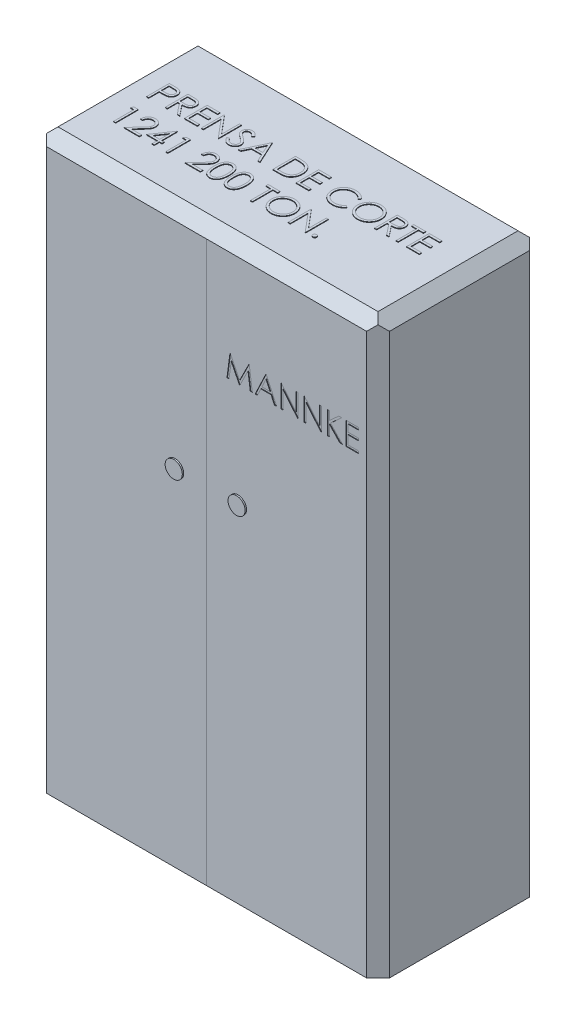
from build123d import *

# Parameters (mm, degrees)
CROQUIS1_W                 = 1200
CROQUIS1_H                 = 570
SALIENTE_EXTRUIR1_DEPTH    = 2000
CORTAR_EXTRUIR1_DEPTH      = 2165.462981896
CORTAR_EXTRUIR1_DEPTH_BACK = 0.1
CROQUIS3_R                 = 30
SALIENTE_EXTRUIR2_DEPTH    = 5
CHAFL_N1_SIZE              = 40
CHAFL_N2_SIZE              = 40
CHAFL_N3_SIZE              = 40
CHAFL_N4_SIZE              = 40
CHAFL_N5_SIZE              = 40
CHAFL_N6_SIZE              = 40
CHAFL_N7_SIZE              = 40
CHAFL_N8_SIZE              = 40
CORTAR_EXTRUIR2_DEPTH      = 2
SALIENTE_EXTRUIR3_DEPTH    = 2


with BuildPart() as part:
    # Croquis1 → Saliente-Extruir1 (new body)
    with BuildSketch(Plane(origin=(0, 0, 0), x_dir=(1, 0, 0), z_dir=(0, 1, 0))):
        Rectangle(CROQUIS1_W, CROQUIS1_H)
    extrude(amount=SALIENTE_EXTRUIR1_DEPTH)

    # Croquis2 → Cortar-Extruir1 (cut, two sides: drawn at the far end of the back side and taken through both)
    with BuildSketch(Plane.XY.offset(285).offset(-CORTAR_EXTRUIR1_DEPTH_BACK)):
        Polygon((0, 6186.122603564), (0, 2000), (0, 0), (0, -4186.122603564), (8372.245207128, -4186.122603564), (8372.245207128, 6186.122603564), align=None)
    extrude(amount=CORTAR_EXTRUIR1_DEPTH + CORTAR_EXTRUIR1_DEPTH_BACK, mode=Mode.SUBTRACT)

    # Croquis3 → Saliente-Extruir2 (add)
    with BuildSketch(Plane.XY.offset(285)):
        with Locations(Location((-110, 1209.492031289, 0), (0, 0, 180))):
            Circle(CROQUIS3_R)
        with Locations((110, 1209.492031289)):
            Circle(CROQUIS3_R)
    extrude(amount=SALIENTE_EXTRUIR2_DEPTH)


with BuildPart() as saliente_extruir2_piece_1:
    # of the separate pieces the step leaves, piece 1, a body of its own (saliente_extruir2_pieces)
    add(part.part.solids().sort_by_distance((-600, 0, -285))[0])

    # Chaflán1
    chafl_n1_edges = [saliente_extruir2_piece_1.edges().sort_by_distance(p)[0] for p in [
        (-600, 1000, 285),
    ]]
    chamfer(chafl_n1_edges, length=CHAFL_N1_SIZE)

    # Chaflán2
    chafl_n2_edges = [saliente_extruir2_piece_1.edges().sort_by_distance(p)[0] for p in [
        (-280, 2000, 285),
    ]]
    chamfer(chafl_n2_edges, length=CHAFL_N2_SIZE)

    # Chaflán3
    chafl_n3_edges = [saliente_extruir2_piece_1.edges().sort_by_distance(p)[0] for p in [
        (600, 980.05, 284.9),
    ]]
    chamfer(chafl_n3_edges, length=CHAFL_N3_SIZE)

    # Chaflán4
    chafl_n4_edges = [saliente_extruir2_piece_1.edges().sort_by_distance(p)[0] for p in [
        (600, 2000, -20.05),
    ]]
    chamfer(chafl_n4_edges, length=CHAFL_N4_SIZE)

    # Chaflán5
    chafl_n5_edges = [saliente_extruir2_piece_1.edges().sort_by_distance(p)[0] for p in [
        (600, 980, -285),
    ]]
    chamfer(chafl_n5_edges, length=CHAFL_N5_SIZE)

    # Chaflán6
    chafl_n6_edges = [saliente_extruir2_piece_1.edges().sort_by_distance(p)[0] for p in [
        (-20, 2000, -285),
    ]]
    chamfer(chafl_n6_edges, length=CHAFL_N6_SIZE)

    # Chaflán7
    chafl_n7_edges = [saliente_extruir2_piece_1.edges().sort_by_distance(p)[0] for p in [
        (-600, 980, -285),
    ]]
    chamfer(chafl_n7_edges, length=CHAFL_N7_SIZE)

    # Chaflán8
    chafl_n8_edges = [saliente_extruir2_piece_1.edges().sort_by_distance(p)[0] for p in [
        (-600, 2000, 0),
    ]]
    chamfer(chafl_n8_edges, length=CHAFL_N8_SIZE)

    # Croquis4 → Cortar-Extruir2 (cut)
    # profile 1 of 6: a face of its own
    with BuildSketch(Plane.XY.offset(284.9)):
        Polygon((71.305338997, 1575.200840554), (81.783729422, 1654.575840554), (82.801357627, 1654.575840554), (115.57216592, 1589.447635426), (148.26347201, 1654.575840554), (149.297000656, 1654.575840554), (159.838992844, 1575.200840554), (152.683794526, 1575.200840554), (145.083383869, 1632.315223567), (116.430789719, 1575.200840554), (114.824845207, 1575.200840554), (86.060947972, 1632.442427093), (78.476437755, 1575.200840554), align=None)
    # profile 2 of 6: a face of its own
    with BuildSketch(Plane.XY.offset(284.9)):
        Polygon((208.68514669, 1654.575840554), (245.319762074, 1575.200840554), (237.576247451, 1575.200840554), (225.841722211, 1600.641545682), (189.859024895, 1600.641545682), (177.7905904, 1575.200840554), (170.015274895, 1575.200840554), (207.667518485, 1654.575840554), align=None)
        Polygon((208.096830384, 1639.104711748), (193.722831986, 1608.782571323), (222.089218204, 1608.782571323), align=None, mode=Mode.SUBTRACT)
    # profile 3 of 6: a face of its own
    with BuildSketch(Plane.XY.offset(284.9)):
        Polygon((259.566556946, 1575.200840554), (259.566556946, 1654.575840554), (261.061198372, 1654.575840554), (313.500851818, 1592.103009024), (313.500851818, 1654.575840554), (320.624249254, 1654.575840554), (320.624249254, 1575.200840554), (319.002404302, 1575.200840554), (266.689954382, 1637.530568118), (266.689954382, 1575.200840554), align=None)
    # profile 4 of 6: a face of its own
    with BuildSketch(Plane.XY.offset(284.9)):
        Polygon((340.976813356, 1575.200840554), (340.976813356, 1654.575840554), (342.471454783, 1654.575840554), (394.911108228, 1592.103009024), (394.911108228, 1654.575840554), (402.034505664, 1654.575840554), (402.034505664, 1575.200840554), (400.412660712, 1575.200840554), (348.100210792, 1637.530568118), (348.100210792, 1575.200840554), align=None)
    # profile 5 of 6: a face of its own
    with BuildSketch(Plane.XY.offset(284.9)):
        Polygon((422.387069767, 1654.575840554), (429.510467203, 1654.575840554), (429.510467203, 1624.349102774), (462.59928431, 1654.575840554), (472.75966592, 1654.575840554), (433.755884871, 1618.958853375), (475.812550536, 1575.200840554), (466.319987435, 1575.200840554), (429.510467203, 1613.505002213), (429.510467203, 1575.200840554), (422.387069767, 1575.200840554), align=None)
    # profile 6 of 6: a face of its own
    with BuildSketch(Plane.XY.offset(284.9)):
        Polygon((487.515274895, 1654.575840554), (532.29091592, 1654.575840554), (532.29091592, 1646.434814913), (494.638672331, 1646.434814913), (494.638672331, 1622.01173799), (532.29091592, 1622.01173799), (532.29091592, 1613.870712349), (494.638672331, 1613.870712349), (494.638672331, 1583.341866195), (532.29091592, 1583.341866195), (532.29091592, 1575.200840554), (487.515274895, 1575.200840554), align=None)
    extrude(amount=-CORTAR_EXTRUIR2_DEPTH, mode=Mode.SUBTRACT)

    # Croquis5 → Saliente-Extruir3 (add)
    # profile 1 of 24: a face of its own
    with BuildSketch(Plane(origin=(0, 2000, 0), x_dir=(1, 0, 0), z_dir=(0, 1, 0))):
        with BuildLine():
            Line((-494.736076383, 79.375), (-479.169544933, 79.375))
            add(Edge.make_bspline(
                [(-479.169544933, 79.375), (-478.098869026, 79.373823067), (-476.047406439, 79.371568012), (-473.105654282, 79.303197884), (-470.433897869, 79.211878259), (-468.037898158, 79.085288896), (-465.910283077, 78.935687653), (-464.060680033, 78.725864617), (-462.474550809, 78.506782914), (-461.524172402, 78.284047445), (-461.090743851, 78.182466947)],
                knots=[0, 0, 0, 0, 1.415646017, 2.712440637, 3.8905458, 4.950247383, 5.884950622, 6.709939814, 7.411656543, 8, 8, 8, 8], degree=3))
            add(Edge.make_bspline(
                [(-461.090743851, 78.182466947), (-460.542069067, 78.032290585), (-459.457648334, 77.735476578), (-457.895071106, 77.140986778), (-456.408403539, 76.436087675), (-454.992544982, 75.632723325), (-453.664894169, 74.696425709), (-452.405642883, 73.665149021), (-451.225904044, 72.51508309), (-450.132311764, 71.259127026), (-449.127995819, 69.918365123), (-448.263269085, 68.472782409), (-447.539205187, 66.946711778), (-446.918191708, 65.341214718), (-446.471232116, 63.642809167), (-446.13452564, 61.863296226), (-445.920811228, 60.002866645), (-445.900342417, 58.731508935), (-445.889922537, 58.084309896)],
                knots=[0, 0, 0, 0, 0.999701418, 1.975846123, 2.934577507, 3.890451536, 4.834027766, 5.787354733, 6.749476667, 7.726910423, 8.712836071, 9.690891519, 10.682875813, 11.679750201, 12.712814741, 13.765529915, 14.8625177, 16, 16, 16, 16], degree=3))
            add(Edge.make_bspline(
                [(-445.889922537, 58.084309896), (-445.899479848, 57.431671029), (-445.918179372, 56.154739008), (-446.142612986, 54.286641847), (-446.444922689, 52.501421214), (-446.909766554, 50.803035462), (-447.518588069, 49.201570667), (-448.232782839, 47.672553441), (-449.094195045, 46.241996596), (-450.083997433, 44.904706609), (-451.185078235, 43.659428241), (-452.392778796, 42.51518558), (-453.702223465, 41.478676476), (-455.109250752, 40.547577254), (-456.627577681, 39.743479486), (-458.234176521, 39.023269178), (-459.943011786, 38.418407625), (-461.125529514, 38.100225874), (-461.726761479, 37.938451522)],
                knots=[0, 0, 0, 0, 1.121902311, 2.195077645, 3.232258892, 4.234102512, 5.217864754, 6.176164875, 7.132989551, 8.084763148, 9.034132444, 9.988522005, 10.94243251, 11.903244335, 12.886203696, 13.894208494, 14.929344452, 16, 16, 16, 16], degree=3))
            add(Edge.make_bspline(
                [(-461.726761479, 37.938451522), (-462.22404209, 37.832701773), (-463.31386146, 37.600945048), (-465.108705338, 37.342217545), (-467.198431055, 37.121382672), (-469.580186331, 36.955803302), (-472.251833282, 36.814053875), (-475.214817154, 36.701384602), (-478.474954261, 36.639475417), (-480.748962832, 36.636282438), (-481.936221616, 36.634615385)],
                knots=[0, 0, 0, 0, 0.601384939, 1.31797006, 2.144135048, 3.087295005, 4.142315834, 5.309527816, 6.595305764, 8, 8, 8, 8], degree=3))
            Line((-481.936221616, 36.634615385), (-487.612678947, 36.634615385))
            Line((-487.612678947, 36.634615385), (-487.612678947, 0))
            Line((-487.612678947, 0), (-494.736076383, 0))
            Line((-494.736076383, 0), (-494.736076383, 79.375))
        make_face()
        with BuildLine():
            Line((-487.612678947, 71.233974359), (-487.612678947, 44.775641026))
            Line((-487.612678947, 44.775641026), (-473.715693771, 44.600736178))
            add(Edge.make_bspline(
                [(-473.715693771, 44.600736178), (-473.037152596, 44.600385486), (-471.727242848, 44.599708482), (-469.8350285, 44.690087657), (-468.079496448, 44.794421166), (-466.466039114, 44.947182287), (-464.993929171, 45.163110805), (-463.660711998, 45.38109129), (-462.476725404, 45.696445049), (-461.091082793, 46.12105751), (-459.547049734, 46.845243615), (-457.867303544, 47.896392907), (-456.443756318, 49.236258968), (-455.211894945, 50.742747286), (-454.234315213, 52.418673971), (-453.518670387, 54.2118445), (-453.098183426, 56.103868945), (-453.041800105, 57.39854638), (-453.013319973, 58.052509014)],
                knots=[0, 0, 0, 0, 1.160613943, 2.240541288, 3.23993089, 4.169200891, 5.011653406, 5.7853311, 6.478053781, 7.106038997, 8.262395093, 9.384106736, 10.481365981, 11.59014053, 12.70357646, 13.786202915, 14.881775077, 16, 16, 16, 16], degree=3))
            add(Edge.make_bspline(
                [(-453.013319973, 58.052509014), (-453.041954992, 58.690650302), (-453.098877865, 59.9591962), (-453.52196619, 61.818357379), (-454.232923844, 63.592631389), (-455.218457327, 65.247556717), (-456.41455081, 66.748624236), (-457.804732341, 68.052576939), (-459.385729518, 69.100819126), (-460.856394757, 69.777395335), (-462.162707369, 70.19049176), (-463.297360745, 70.479526534), (-464.578488541, 70.710294747), (-466.006507826, 70.8971549), (-467.570350309, 71.057117324), (-469.283451379, 71.165656451), (-471.139321503, 71.229189476), (-472.427704092, 71.232340783), (-473.095576584, 71.233974359)],
                knots=[0, 0, 0, 0, 1.120700087, 2.227813068, 3.331159281, 4.466773991, 5.599788987, 6.693661531, 7.80175334, 8.91857717, 9.525282508, 10.207424825, 10.974604443, 11.810962634, 12.737642355, 13.736264703, 14.826523623, 16, 16, 16, 16], degree=3))
            Line((-473.095576584, 71.233974359), (-487.612678947, 71.233974359))
        make_face(mode=Mode.SUBTRACT)
    # profile 2 of 24: a face of its own
    with BuildSketch(Plane(origin=(0, 2000, 0), x_dir=(1, 0, 0), z_dir=(0, 1, 0))):
        with BuildLine():
            Line((-429.607871255, 79.375), (-413.723330991, 79.375))
            add(Edge.make_bspline(
                [(-413.723330991, 79.375), (-412.663308969, 79.371471532), (-410.627949265, 79.364696483), (-407.71209117, 79.32691936), (-405.062619506, 79.218643793), (-402.680919578, 79.125466989), (-400.567035081, 78.955560462), (-398.714484023, 78.793167215), (-397.131798741, 78.58058598), (-396.173723185, 78.383159423), (-395.739932553, 78.293770032)],
                knots=[0, 0, 0, 0, 1.410062039, 2.707475311, 3.878576406, 4.937260626, 5.877586885, 6.699081471, 7.410979367, 8, 8, 8, 8], degree=3))
            add(Edge.make_bspline(
                [(-395.739932553, 78.293770032), (-395.159210899, 78.150288032), (-394.010155959, 77.866384892), (-392.355752675, 77.266318945), (-390.779267114, 76.5719096), (-389.287247884, 75.7563038), (-387.887168334, 74.81344719), (-386.564592357, 73.759616556), (-385.313518455, 72.60057814), (-384.184542199, 71.307109413), (-383.120031563, 69.950102854), (-382.222218069, 68.482714083), (-381.448278261, 66.948247298), (-380.83208975, 65.331096931), (-380.335928566, 63.646946033), (-379.986083495, 61.880539393), (-379.776279775, 60.039924422), (-379.754919837, 58.784486134), (-379.744089204, 58.147911659)],
                knots=[0, 0, 0, 0, 1.027469482, 2.033020251, 3.019912614, 3.986113645, 4.951240523, 5.91722682, 6.890402269, 7.87763091, 8.8651537, 9.85103654, 10.82876324, 11.815024772, 12.821070561, 13.842952187, 14.906261191, 16, 16, 16, 16], degree=3))
            add(Edge.make_bspline(
                [(-379.744089204, 58.147911659), (-379.777403982, 57.090294108), (-379.842409744, 55.026608336), (-380.448496917, 52.031656204), (-381.441285846, 49.237898533), (-382.809331865, 46.648852994), (-384.551487832, 44.314986573), (-386.645282202, 42.265060176), (-389.091883034, 40.549655015), (-391.369476449, 39.360100337), (-393.381387763, 38.598261159), (-395.037678964, 38.062222307), (-396.844412204, 37.648067023), (-398.784276756, 37.277042606), (-400.865345372, 36.996923822), (-403.082630194, 36.791759983), (-405.437712561, 36.663534236), (-407.055580741, 36.644438768), (-407.887869252, 36.634615385)],
                knots=[0, 0, 0, 0, 1.260483769, 2.459530307, 3.627416485, 4.787058657, 5.939039949, 7.08810263, 8.267026773, 9.491475466, 10.141966685, 10.831826277, 11.566392101, 12.351337768, 13.187381173, 14.07005841, 15.007169909, 16, 16, 16, 16], degree=3))
            Line((-407.887869252, 36.634615385), (-378.726460999, 0))
            Line((-378.726460999, 0), (-387.535305149, 0))
            Line((-387.535305149, 0), (-416.696713402, 36.634615385))
            Line((-416.696713402, 36.634615385), (-422.484473819, 36.634615385))
            Line((-422.484473819, 36.634615385), (-422.484473819, 0))
            Line((-422.484473819, 0), (-429.607871255, 0))
            Line((-429.607871255, 0), (-429.607871255, 79.375))
        make_face()
        with BuildLine():
            Line((-422.484473819, 71.233974359), (-422.484473819, 44.775641026))
            Line((-422.484473819, 44.775641026), (-407.951471015, 44.664337941))
            add(Edge.make_bspline(
                [(-407.951471015, 44.664337941), (-407.272927275, 44.664037752), (-405.957716247, 44.663455902), (-404.054969027, 44.754029041), (-402.283316494, 44.857065009), (-400.649535151, 45.014666238), (-399.152895139, 45.21777715), (-397.794144518, 45.471844829), (-396.571065305, 45.767846964), (-395.144616309, 46.225990977), (-393.551752115, 46.951841749), (-391.82066365, 48.007880737), (-390.346503491, 49.33614469), (-389.101044828, 50.855006996), (-388.100252364, 52.524971925), (-387.394675417, 54.326021727), (-386.94694503, 56.212688325), (-386.894136945, 57.509406128), (-386.86748664, 58.163812099)],
                knots=[0, 0, 0, 0, 1.146690395, 2.22261258, 3.21895312, 4.145990853, 4.996080663, 5.770904154, 6.481378293, 7.121626537, 8.300444488, 9.431385265, 10.535395872, 11.636531494, 12.74115979, 13.810798291, 14.895190096, 16, 16, 16, 16], degree=3))
            add(Edge.make_bspline(
                [(-386.86748664, 58.163812099), (-386.894749029, 58.802136182), (-386.948773136, 60.067061595), (-387.389843422, 61.918900989), (-388.135727606, 63.666669322), (-389.140892645, 65.30325675), (-390.365516338, 66.788833259), (-391.801473876, 68.059902623), (-393.409502409, 69.108774412), (-394.912438514, 69.779025541), (-396.255785833, 70.189957927), (-397.422137052, 70.479136107), (-398.74002235, 70.711466027), (-400.215840787, 70.897613122), (-401.843292056, 71.057609179), (-403.630605036, 71.165372731), (-405.565921303, 71.229187149), (-406.907289207, 71.232341486), (-407.601661319, 71.233974359)],
                knots=[0, 0, 0, 0, 1.101028733, 2.181837193, 3.264309656, 4.369019818, 5.486613113, 6.575447106, 7.666700264, 8.788928104, 9.402425223, 10.0903467, 10.862060571, 11.710948788, 12.657782767, 13.684531032, 14.801375019, 16, 16, 16, 16], degree=3))
            Line((-407.601661319, 71.233974359), (-422.484473819, 71.233974359))
        make_face(mode=Mode.SUBTRACT)
    # profile 3 of 24: a face of its own
    with BuildSketch(Plane(origin=(0, 2000, 0), x_dir=(1, 0, 0), z_dir=(0, 1, 0))):
        Polygon((-362.444409717, 79.375), (-317.668768691, 79.375), (-317.668768691, 71.233974359), (-355.321012281, 71.233974359), (-355.321012281, 46.810897436), (-317.668768691, 46.810897436), (-317.668768691, 38.669871795), (-355.321012281, 38.669871795), (-355.321012281, 8.141025641), (-317.668768691, 8.141025641), (-317.668768691, 0), (-362.444409717, 0), align=None)
    # profile 4 of 24: a face of its own
    with BuildSketch(Plane(origin=(0, 2000, 0), x_dir=(1, 0, 0), z_dir=(0, 1, 0))):
        Polygon((-303.421973819, 0), (-303.421973819, 79.375), (-301.927332393, 79.375), (-249.487678947, 16.90216847), (-249.487678947, 79.375), (-242.364281511, 79.375), (-242.364281511, 0), (-243.986126463, 0), (-296.298576383, 62.329727564), (-296.298576383, 0), align=None)
    # profile 5 of 24: a face of its own
    with BuildSketch(Plane(origin=(0, 2000, 0), x_dir=(1, 0, 0), z_dir=(0, 1, 0))):
        with BuildLine():
            Line((-230.15274305, 15.312124399), (-223.442757072, 19.334935897))
            add(Edge.make_bspline(
                [(-223.442757072, 19.334935897), (-222.818682763, 18.290261453), (-221.62298047, 16.288705532), (-219.62836929, 13.584103544), (-217.561605054, 11.285354632), (-215.407382668, 9.405831568), (-213.178851345, 7.926080029), (-210.861462983, 6.878279417), (-208.463026919, 6.224774261), (-206.830763468, 6.145397298), (-206.01587406, 6.105769231)],
                knots=[0, 0, 0, 0, 1.272034388, 2.437168799, 3.508375237, 4.49857839, 5.41946034, 6.295179144, 7.148887113, 8, 8, 8, 8], degree=3))
            add(Edge.make_bspline(
                [(-206.01587406, 6.105769231), (-205.319939901, 6.125151982), (-203.940248798, 6.163578333), (-201.909105074, 6.532803665), (-199.936482058, 7.100043017), (-198.063036167, 7.912410571), (-196.314617766, 8.895265515), (-194.781394497, 10.082402041), (-193.455920144, 11.411507063), (-192.371677725, 12.894292267), (-191.539826924, 14.488984744), (-190.900471087, 16.125832212), (-190.545663167, 17.830547957), (-190.492215365, 18.978320954), (-190.46524305, 19.557542067)],
                knots=[0, 0, 0, 0, 1.095163259, 2.171163733, 3.241058638, 4.321873601, 5.38011039, 6.391990106, 7.366004449, 8.327778327, 9.272591725, 10.192022065, 11.087607919, 12, 12, 12, 12], degree=3))
            add(Edge.make_bspline(
                [(-190.46524305, 19.557542067), (-190.49867831, 20.218414909), (-190.566647309, 21.561872824), (-191.141129089, 23.543972096), (-192.04485308, 25.505500023), (-192.878577321, 26.718832296), (-193.311421936, 27.348758013)],
                knots=[0, 0, 0, 0, 0.938893495, 1.908633276, 2.914225137, 4, 4, 4, 4], degree=3))
            add(Edge.make_bspline(
                [(-193.311421936, 27.348758013), (-193.666809079, 27.803391334), (-194.412899932, 28.757837123), (-195.695543521, 30.17854157), (-197.200632185, 31.643995), (-198.876659234, 33.210155756), (-200.784677498, 34.804182574), (-202.864926486, 36.502088163), (-205.170517573, 38.239302499), (-206.7874883, 39.404358896), (-207.621818571, 40.005508814)],
                knots=[0, 0, 0, 0, 0.722233717, 1.516239348, 2.393582979, 3.351407094, 4.387010283, 5.505090956, 6.712668013, 8, 8, 8, 8], degree=3))
            add(Edge.make_bspline(
                [(-207.621818571, 40.005508814), (-208.456934198, 40.600335712), (-210.053611685, 41.737599445), (-212.286511678, 43.425435886), (-214.283234321, 44.968573642), (-216.034904874, 46.38153963), (-217.540752874, 47.664525488), (-218.812644517, 48.805210893), (-219.818179651, 49.83444522), (-220.377332998, 50.502132792), (-220.628379068, 50.801908053)],
                knots=[0, 0, 0, 0, 1.452282411, 2.77665338, 3.964542531, 5.026858415, 5.96415736, 6.766646006, 7.446254459, 8, 8, 8, 8], degree=3))
            add(Edge.make_bspline(
                [(-220.628379068, 50.801908053), (-220.97927429, 51.269110139), (-221.669356837, 52.187925742), (-222.580264461, 53.624043052), (-223.354491903, 55.094142107), (-223.961423364, 56.602173321), (-224.472512612, 58.126965458), (-224.816272827, 59.688413352), (-225.03152415, 61.279510592), (-225.053567416, 62.350245338), (-225.064602024, 62.886242989)],
                knots=[0, 0, 0, 0, 1.068054152, 2.10047183, 3.106115577, 4.101338837, 5.06977816, 6.043150881, 7.020423561, 8, 8, 8, 8], degree=3))
            add(Edge.make_bspline(
                [(-225.064602024, 62.886242989), (-225.035001749, 63.726025376), (-224.976433883, 65.387640393), (-224.481122152, 67.814946726), (-223.699326171, 70.132388688), (-222.604067107, 72.317023042), (-221.192159282, 74.311965823), (-219.558259506, 76.140164546), (-217.612177586, 77.677059178), (-215.476930594, 79.019904074), (-213.139759299, 80.070963449), (-210.690679883, 80.863828535), (-208.125799856, 81.3130742), (-206.388550196, 81.377544048), (-205.507059957, 81.41025641)],
                knots=[0, 0, 0, 0, 1.005424448, 1.989358655, 2.955360095, 3.929531133, 4.905563448, 5.876582895, 6.856512386, 7.866279853, 8.892233794, 9.918561126, 10.94386622, 12, 12, 12, 12], degree=3))
            add(Edge.make_bspline(
                [(-205.507059957, 81.41025641), (-204.571702682, 81.377994972), (-202.711575598, 81.313837269), (-199.975423745, 80.756000398), (-197.341064641, 79.832967305), (-195.221904885, 78.785474526), (-193.563358331, 77.73927992), (-192.298512429, 76.786330334), (-191.016777384, 75.689251978), (-189.707814355, 74.445122647), (-188.393802971, 73.042526685), (-187.055235393, 71.49106999), (-185.68898144, 69.800233812), (-184.810053898, 68.59317817), (-184.359473819, 67.974384014)],
                knots=[0, 0, 0, 0, 1.286793592, 2.559021753, 3.825965368, 5.121522368, 5.803751409, 6.523245864, 7.299691795, 8.125521123, 9.008227632, 9.944561021, 10.946284179, 12, 12, 12, 12], degree=3))
            Line((-184.359473819, 67.974384014), (-190.799152305, 63.092948718))
            add(Edge.make_bspline(
                [(-190.799152305, 63.092948718), (-191.187997559, 63.593888661), (-191.936822603, 64.558581869), (-193.073687752, 65.909574205), (-194.145219589, 67.143662223), (-195.200916155, 68.215567805), (-196.185021726, 69.183991186), (-197.140176077, 70.013114242), (-198.052633685, 70.711060781), (-199.202820766, 71.455905802), (-200.647847592, 72.194240793), (-202.46178261, 72.819014528), (-204.357399919, 73.194459683), (-205.648482633, 73.244100526), (-206.302081992, 73.269230769)],
                knots=[0, 0, 0, 0, 1.181633172, 2.275549214, 3.290209073, 4.226197932, 5.078386478, 5.862611352, 6.581680152, 7.217281963, 8.414376989, 9.595101626, 10.782541182, 12, 12, 12, 12], degree=3))
            add(Edge.make_bspline(
                [(-206.302081992, 73.269230769), (-207.122060268, 73.241751145), (-208.703311129, 73.188759279), (-210.948268269, 72.61000247), (-212.968791213, 71.698735281), (-214.704894028, 70.421592028), (-216.150357614, 68.908455229), (-217.195963554, 67.16722048), (-217.825297643, 65.244476707), (-217.902093628, 63.903228429), (-217.941204588, 63.220152244)],
                knots=[0, 0, 0, 0, 1.14458467, 2.207223713, 3.21896685, 4.227309161, 5.202851033, 6.127160689, 7.046193047, 8, 8, 8, 8], degree=3))
            add(Edge.make_bspline(
                [(-217.941204588, 63.220152244), (-217.932289038, 62.794895498), (-217.914443358, 61.943686629), (-217.665550625, 60.686127595), (-217.345797986, 59.431745433), (-216.839099016, 58.186179715), (-216.139571595, 56.92764693), (-215.22097207, 55.634475382), (-214.064063029, 54.295266989), (-213.177852213, 53.424242619), (-212.709959596, 52.964367989)],
                knots=[0, 0, 0, 0, 0.858281714, 1.717966888, 2.583508476, 3.4729293, 4.427298488, 5.488583878, 6.674047936, 8, 8, 8, 8], degree=3))
            add(Edge.make_bspline(
                [(-212.709959596, 52.964367989), (-212.536210615, 52.80931401), (-212.123422807, 52.44094125), (-211.368772348, 51.837866314), (-210.37221246, 51.0939463), (-209.159766111, 50.173483944), (-207.709077729, 49.105743642), (-206.019987795, 47.904377795), (-204.111324461, 46.530386135), (-202.756916726, 45.569777625), (-202.040763883, 45.061848958)],
                knots=[0, 0, 0, 0, 0.420754252, 0.999615792, 1.744751191, 2.668019286, 3.750313428, 4.999500688, 6.413464383, 8, 8, 8, 8], degree=3))
            add(Edge.make_bspline(
                [(-202.040763883, 45.061848958), (-201.179297635, 44.434982411), (-199.511187642, 43.221142225), (-197.137703241, 41.397429482), (-194.985647236, 39.613810444), (-193.047463869, 37.881675426), (-191.30400541, 36.214163317), (-189.774614244, 34.59121262), (-188.443706851, 33.024450526), (-187.010892432, 31.015751041), (-185.546813311, 28.548751451), (-184.289479125, 25.526191399), (-183.496673745, 22.491881987), (-183.392998306, 20.452469803), (-183.341845614, 19.446238982)],
                knots=[0, 0, 0, 0, 1.163667725, 2.253281268, 3.268753668, 4.215851969, 5.092017293, 5.902905408, 6.650798638, 7.335211899, 8.59617414, 9.77448103, 10.901945474, 12, 12, 12, 12], degree=3))
            add(Edge.make_bspline(
                [(-183.341845614, 19.446238982), (-183.356748568, 18.734622488), (-183.38626507, 17.325208611), (-183.725557222, 15.255673832), (-184.222663914, 13.245652323), (-184.971901184, 11.319989595), (-185.886372809, 9.443456584), (-187.046750216, 7.665277414), (-188.391763781, 5.946096589), (-189.934672377, 4.331756695), (-191.622999091, 2.849798322), (-193.40743288, 1.531514249), (-195.290894427, 0.432321915), (-197.263166252, -0.464634681), (-199.324701388, -1.166162668), (-201.474806486, -1.674454521), (-203.717025758, -1.986414394), (-205.241036679, -2.018793984), (-206.01587406, -2.03525641)],
                knots=[0, 0, 0, 0, 0.983748083, 1.948392443, 2.894712957, 3.844097841, 4.80183111, 5.778335162, 6.776009319, 7.81870978, 8.863265674, 9.881300176, 10.883814829, 11.87499822, 12.874611388, 13.892143829, 14.928324115, 16, 16, 16, 16], degree=3))
            add(Edge.make_bspline(
                [(-206.01587406, -2.03525641), (-206.615389874, -2.023663542), (-207.806871218, -2.000623805), (-209.569211253, -1.796941196), (-211.295948365, -1.508762239), (-212.965415118, -1.051243152), (-214.599120704, -0.49614028), (-216.189959773, 0.187354048), (-217.738703315, 1.006440581), (-219.254030641, 1.942952747), (-220.732087815, 3.03283374), (-222.159011462, 4.302232677), (-223.581619777, 5.716139665), (-224.957923229, 7.312950655), (-226.315760609, 9.066867892), (-227.628360254, 10.994301158), (-228.922892065, 13.084751859), (-229.735135711, 14.555799339), (-230.15274305, 15.312124399)],
                knots=[0, 0, 0, 0, 0.915332311, 1.819136955, 2.706846663, 3.586547465, 4.459518054, 5.340707479, 6.227863349, 7.133153174, 8.059268498, 9.028702269, 10.047606654, 11.120612155, 12.245963614, 13.433783089, 14.680604001, 16, 16, 16, 16], degree=3))
        make_face()
    # profile 6 of 24: a face of its own
    with BuildSketch(Plane(origin=(0, 2000, 0), x_dir=(1, 0, 0), z_dir=(0, 1, 0))):
        Polygon((-134.495691768, 79.375), (-97.861076383, 0), (-105.604591007, 0), (-117.339116247, 25.440705128), (-153.321813563, 25.440705128), (-165.390248058, 0), (-173.165563563, 0), (-135.513319973, 79.375), align=None)
        Polygon((-135.084008074, 63.903871194), (-149.458006471, 33.581730769), (-121.091620253, 33.581730769), align=None, mode=Mode.SUBTRACT)
    # profile 7 of 24: a face of its own
    with BuildSketch(Plane(origin=(0, 2000, 0), x_dir=(1, 0, 0), z_dir=(0, 1, 0))):
        with BuildLine():
            Line((-53.085435358, 0), (-53.085435358, 79.375))
            Line((-53.085435358, 79.375), (-37.057791127, 79.375))
            add(Edge.make_bspline(
                [(-37.057791127, 79.375), (-35.663762287, 79.364963145), (-32.970505824, 79.345571993), (-29.078580676, 79.222622586), (-25.477591777, 79.005124522), (-22.179382295, 78.688315625), (-19.174897666, 78.299309327), (-16.47255066, 77.811710871), (-14.058368134, 77.235943436), (-12.573614749, 76.745055546), (-11.87149305, 76.512920673)],
                knots=[0, 0, 0, 0, 1.314313732, 2.53924729, 3.670748893, 4.714932338, 5.66265055, 6.526160246, 7.303039223, 8, 8, 8, 8], degree=3))
            add(Edge.make_bspline(
                [(-11.87149305, 76.512920673), (-10.953130212, 76.162974313), (-9.137229958, 75.471017215), (-6.551711286, 74.165722524), (-4.117725376, 72.686782538), (-1.822219769, 71.032247795), (0.282370401, 69.155270606), (2.278263774, 67.135583128), (4.083811974, 64.899740413), (5.737267974, 62.494111221), (7.228058822, 59.947034323), (8.523893295, 57.263363107), (9.600082072, 54.456726425), (10.493464175, 51.534929318), (11.19755348, 48.491547179), (11.677929431, 45.323036288), (11.994771523, 42.041918957), (12.026613401, 39.815462369), (12.042769771, 38.685772236)],
                knots=[0, 0, 0, 0, 0.984719456, 1.947108742, 2.898477687, 3.838006223, 4.779231079, 5.722358779, 6.681677486, 7.655904652, 8.64651281, 9.637519902, 10.640069247, 11.656948941, 12.698408672, 13.768548281, 14.867775369, 16, 16, 16, 16], degree=3))
            add(Edge.make_bspline(
                [(12.042769771, 38.685772236), (12.028505687, 37.704669148), (12.00039682, 35.771303042), (11.747999835, 32.921947017), (11.381144005, 30.157121381), (10.813177375, 27.489992112), (10.123691803, 24.897191456), (9.240040515, 22.406353058), (8.227771226, 19.994627382), (7.047354338, 17.69462391), (5.751469356, 15.515590288), (4.360779823, 13.461466704), (2.876769052, 11.561564352), (1.285285949, 9.810129757), (-0.393103335, 8.209803247), (-2.16938726, 6.747216471), (-4.048149305, 5.450987459), (-6.020974624, 4.270179826), (-8.145415411, 3.240111049), (-10.461710948, 2.368573327), (-12.979739449, 1.646337585), (-15.693320258, 1.043747627), (-18.607141985, 0.565744514), (-21.724061389, 0.245378114), (-25.039289565, 0.028731247), (-27.315747902, 0.009763041), (-28.487453587, 0)],
                knots=[0, 0, 0, 0, 1.105936401, 2.179363191, 3.223086493, 4.248585256, 5.251745608, 6.245858792, 7.225916811, 8.198733463, 9.158002045, 10.082870192, 10.993790845, 11.873723703, 12.748670949, 13.606408763, 14.465103618, 15.319838547, 16.196477973, 17.123216899, 18.106603292, 19.147568657, 20.255746949, 21.433717677, 22.679120308, 24, 24, 24, 24], degree=3))
            Line((-28.487453587, 0), (-53.085435358, 0))
        make_face()
        with BuildLine():
            Line((-45.962037922, 8.141025641), (-36.851085398, 8.141025641))
            add(Edge.make_bspline(
                [(-36.851085398, 8.141025641), (-35.541888418, 8.146652112), (-33.023823169, 8.157473877), (-29.403007873, 8.252433663), (-26.09467156, 8.407599031), (-23.098344472, 8.624748117), (-20.415718385, 8.912054211), (-18.041186915, 9.232386827), (-15.982533735, 9.631471871), (-14.736812576, 9.993216844), (-14.161156511, 10.160381611)],
                knots=[0, 0, 0, 0, 1.375205317, 2.645023457, 3.804390687, 4.853969522, 5.800190428, 6.637939096, 7.370582563, 8, 8, 8, 8], degree=3))
            add(Edge.make_bspline(
                [(-14.161156511, 10.160381611), (-13.4366133, 10.415550878), (-12.004832577, 10.9197947), (-9.943779395, 11.839584516), (-8.02161161, 12.929110026), (-6.20483068, 14.140197311), (-4.519208316, 15.515562), (-2.944768535, 17.025296925), (-1.484681254, 18.677085574), (-0.154031769, 20.468877809), (1.036781554, 22.389521389), (2.068004078, 24.420134224), (2.971779884, 26.538467241), (3.681133681, 28.777049946), (4.237112108, 31.115869664), (4.630918424, 33.555090929), (4.876180925, 36.094258214), (4.904788762, 37.821279604), (4.919372335, 38.701672676)],
                knots=[0, 0, 0, 0, 0.998632004, 1.973411704, 2.929992603, 3.868527914, 4.809262121, 5.754881198, 6.702106254, 7.672490631, 8.653608572, 9.636854334, 10.631411391, 11.644891563, 12.686317036, 13.754757253, 14.855430412, 16, 16, 16, 16], degree=3))
            add(Edge.make_bspline(
                [(4.919372335, 38.701672676), (4.907731711, 39.629985533), (4.884863601, 41.453664357), (4.597428347, 44.129524768), (4.177385928, 46.703103806), (3.569970191, 49.174573595), (2.795930617, 51.548755867), (1.829944991, 53.812519759), (0.72625559, 55.989773036), (-0.58690937, 58.030263116), (-2.025084434, 59.960053269), (-3.621154198, 61.72795939), (-5.349761143, 63.3380087), (-7.192051479, 64.815275255), (-9.199946408, 66.100326476), (-11.326146181, 67.249827994), (-13.601842653, 68.225366958), (-15.185094862, 68.744226881), (-15.989707193, 69.00791266)],
                knots=[0, 0, 0, 0, 1.122418816, 2.205001699, 3.251619955, 4.274784885, 5.280384055, 6.268708349, 7.249350384, 8.229342522, 9.199999885, 10.157847722, 11.105861043, 12.055065948, 13.010012805, 13.98527497, 14.976112212, 16, 16, 16, 16], degree=3))
            add(Edge.make_bspline(
                [(-15.989707193, 69.00791266), (-16.655349262, 69.191981649), (-18.070686934, 69.583362824), (-20.380260494, 70.010295379), (-22.979568347, 70.386861696), (-25.880150854, 70.705677946), (-29.078701623, 70.934443983), (-32.577680618, 71.106150582), (-36.378600222, 71.221961712), (-39.013454115, 71.229869893), (-40.380983234, 71.233974359)],
                knots=[0, 0, 0, 0, 0.674548936, 1.434276114, 2.292660221, 3.240891867, 4.284742987, 5.42552168, 6.663806718, 8, 8, 8, 8], degree=3))
            Line((-40.380983234, 71.233974359), (-45.962037922, 71.233974359))
            Line((-45.962037922, 71.233974359), (-45.962037922, 8.141025641))
        make_face(mode=Mode.SUBTRACT)
    # profile 8 of 24: a face of its own
    with BuildSketch(Plane(origin=(0, 2000, 0), x_dir=(1, 0, 0), z_dir=(0, 1, 0))):
        Polygon((28.324821053, 79.375), (73.100462078, 79.375), (73.100462078, 71.233974359), (35.448218489, 71.233974359), (35.448218489, 46.810897436), (73.100462078, 46.810897436), (73.100462078, 38.669871795), (35.448218489, 38.669871795), (35.448218489, 8.141025641), (73.100462078, 8.141025641), (73.100462078, 0), (28.324821053, 0), align=None)
    # profile 9 of 24: a face of its own
    with BuildSketch(Plane(origin=(0, 2000, 0), x_dir=(1, 0, 0), z_dir=(0, 1, 0))):
        with BuildLine():
            Line((191.145333873, 64.810196314), (184.912361117, 60.040064103))
            add(Edge.make_bspline(
                [(184.912361117, 60.040064103), (184.467727577, 60.569970918), (183.584455122, 61.622640257), (182.163433922, 63.100819212), (180.68248595, 64.485692105), (179.142177308, 65.783856161), (177.514782991, 66.949914955), (175.839725592, 68.044634611), (174.08898421, 69.025885097), (171.668007371, 70.215670675), (168.500993669, 71.457235262), (164.514217854, 72.498254972), (160.352448299, 73.160949492), (157.513145593, 73.232723575), (156.068961678, 73.269230769)],
                knots=[0, 0, 0, 0, 0.757959112, 1.505699292, 2.245454638, 2.979532153, 3.711538275, 4.438200793, 5.171680507, 5.909471876, 7.393775596, 8.890124382, 10.418191784, 12, 12, 12, 12], degree=3))
            add(Edge.make_bspline(
                [(156.068961678, 73.269230769), (155.273322568, 73.260069477), (153.689428629, 73.241831917), (151.338829319, 73.001232113), (149.032122624, 72.663067171), (146.770809015, 72.161296448), (144.55776692, 71.526917408), (142.378528516, 70.768876771), (140.26464527, 69.831008081), (138.186874511, 68.794410043), (136.196167404, 67.62357335), (134.312597571, 66.346466977), (132.543034727, 64.977382111), (130.886079059, 63.511187377), (129.340036659, 61.954485773), (127.916110146, 60.290687312), (126.619226735, 58.525111234), (125.423679916, 56.681039313), (124.352962571, 54.763842967), (123.456481377, 52.766426191), (122.662615213, 50.722993854), (122.03443596, 48.6104586), (121.537219239, 46.44368516), (121.194145447, 44.216858362), (120.956281904, 41.934630271), (120.938135035, 40.387740503), (120.928987719, 39.607997796)],
                knots=[0, 0, 0, 0, 1.054917814, 2.100044995, 3.131103042, 4.146048494, 5.169673617, 6.183595914, 7.203665975, 8.234915748, 9.262203917, 10.264457458, 11.251630812, 12.227803204, 13.197192746, 14.159520551, 15.12972552, 16.100847026, 17.073214652, 18.039054194, 19.002613845, 19.979014051, 20.95965708, 21.949030935, 22.966165397, 24, 24, 24, 24], degree=3))
            add(Edge.make_bspline(
                [(120.928987719, 39.607997796), (120.957603972, 38.434805363), (121.013788189, 36.131397635), (121.513812908, 32.757492717), (122.273660514, 29.525327437), (123.412478063, 26.455106013), (124.816713674, 23.508970035), (126.59109897, 20.736767467), (128.646152585, 18.096606093), (131.010947455, 15.6508821), (133.605507925, 13.416731544), (136.389255206, 11.449352285), (139.355256018, 9.809354057), (142.470761738, 8.444649556), (145.759746822, 7.395613054), (149.216296805, 6.657105253), (152.83289384, 6.175362944), (155.304164159, 6.129241804), (156.56187534, 6.105769231)],
                knots=[0, 0, 0, 0, 1.029171465, 2.020641659, 2.987623507, 3.938342917, 4.889210282, 5.84687017, 6.821220943, 7.821438502, 8.827599549, 9.822697543, 10.807740252, 11.797342354, 12.80366471, 13.83203677, 14.896651826, 16, 16, 16, 16], degree=3))
            add(Edge.make_bspline(
                [(156.56187534, 6.105769231), (157.947597036, 6.144068343), (160.675028828, 6.219450158), (164.674803711, 6.8580617), (168.503757682, 7.893518051), (172.162096698, 9.342631647), (175.639507424, 11.226433712), (178.941431685, 13.510117717), (182.070656587, 16.215406692), (183.952326738, 18.281041922), (184.912361117, 19.334935897)],
                knots=[0, 0, 0, 0, 1.028121516, 2.023589091, 2.998037872, 3.967518031, 4.937445131, 5.927275754, 6.942489185, 8, 8, 8, 8], degree=3))
            Line((184.912361117, 19.334935897), (191.145333873, 14.612505008))
            add(Edge.make_bspline(
                [(191.145333873, 14.612505008), (190.643726738, 13.965293688), (189.642915139, 12.673971152), (188.022349396, 10.85352345), (186.31516783, 9.141199788), (184.508690121, 7.55080552), (182.623697348, 6.050516747), (180.626343121, 4.682957359), (178.542884706, 3.429039091), (176.380381345, 2.280892767), (174.141130661, 1.262233772), (171.827815798, 0.390157252), (169.450408103, -0.361067921), (167.008798895, -0.979102915), (164.497923695, -1.46150071), (161.9268433, -1.783982621), (159.29000863, -2.004915324), (157.511069258, -2.025051986), (156.609576662, -2.03525641)],
                knots=[0, 0, 0, 0, 0.986787822, 1.968848986, 2.935600012, 3.899624008, 4.868462664, 5.837806735, 6.815139263, 7.798259679, 8.787526145, 9.778297419, 10.776456485, 11.791383307, 12.812564526, 13.85620153, 14.913611965, 16, 16, 16, 16], degree=3))
            add(Edge.make_bspline(
                [(156.609576662, -2.03525641), (155.755872069, -2.029314793), (154.067776955, -2.017565982), (151.575430266, -1.827243614), (149.149059416, -1.567579937), (146.795599151, -1.176598394), (144.502206503, -0.715217824), (142.289671819, -0.096744683), (140.136223298, 0.596066774), (138.050512714, 1.41034058), (136.030765951, 2.32918972), (134.083497372, 3.367676859), (132.209602566, 4.517069147), (130.3906582, 5.752030991), (128.653534427, 7.112230515), (126.983177692, 8.578777405), (125.370221534, 10.14672872), (124.3723035, 11.277365573), (123.87056925, 11.845828325)],
                knots=[0, 0, 0, 0, 1.114604814, 2.203992996, 3.262667896, 4.300477797, 5.318619304, 6.316056647, 7.298880507, 8.271930387, 9.238335007, 10.195173496, 11.151986948, 12.108099108, 13.064862484, 14.031167946, 15.010108607, 16, 16, 16, 16], degree=3))
            add(Edge.make_bspline(
                [(123.87056925, 11.845828325), (123.066939478, 12.833280288), (121.469382057, 14.796262828), (119.425460305, 17.977748474), (117.675863963, 21.299438211), (116.261267189, 24.778783025), (115.155398062, 28.407975557), (114.389288816, 32.188845259), (113.891457786, 36.117861091), (113.834528023, 38.790231119), (113.805590283, 40.14861278)],
                knots=[0, 0, 0, 0, 0.994628077, 1.977248131, 2.950237994, 3.925870899, 4.908910175, 5.911660606, 6.938484602, 8, 8, 8, 8], degree=3))
            add(Edge.make_bspline(
                [(113.805590283, 40.14861278), (113.840859852, 41.57635253), (113.910250525, 44.385341355), (114.49979803, 48.507714939), (115.448188586, 52.457219877), (116.795225167, 56.22648337), (118.503042955, 59.835330797), (120.612753662, 63.256193836), (123.09984778, 66.510949828), (125.944819404, 69.550212938), (129.064650044, 72.329230399), (132.405630288, 74.774121091), (135.961220871, 76.808786186), (139.692250721, 78.509592012), (143.626658143, 79.816886087), (147.756048835, 80.732038714), (152.07266351, 81.30165903), (155.017757806, 81.373668209), (156.514174017, 81.41025641)],
                knots=[0, 0, 0, 0, 1.032925535, 2.032216505, 3.007276963, 3.968222605, 4.92396291, 5.891752235, 6.871517503, 7.883894988, 8.900124299, 9.891468569, 10.874487609, 11.85992873, 12.854644235, 13.869047385, 14.917252991, 16, 16, 16, 16], degree=3))
            add(Edge.make_bspline(
                [(156.514174017, 81.41025641), (157.426180792, 81.399322205), (159.231406356, 81.377679046), (161.901868294, 81.166629038), (164.501792495, 80.814802611), (167.032970123, 80.335920313), (169.507715169, 79.741575701), (171.907113489, 78.967322507), (174.245244423, 78.082029744), (176.507361805, 77.062435963), (178.682612138, 75.917922363), (180.770317933, 74.661175186), (182.753895979, 73.293752454), (184.647303792, 71.827284012), (186.418867864, 70.230745256), (188.11888711, 68.548049776), (189.689629418, 66.730729121), (190.659210804, 65.451545798), (191.145333873, 64.810196314)],
                knots=[0, 0, 0, 0, 1.096760587, 2.17092713, 3.219439832, 4.250915756, 5.268269357, 6.278326846, 7.281116186, 8.274029601, 9.260640565, 10.235837813, 11.203064059, 12.156899882, 13.114053108, 14.069676657, 15.032185724, 16, 16, 16, 16], degree=3))
        make_face()
    # profile 10 of 24: a face of its own
    with BuildSketch(Plane(origin=(0, 2000, 0), x_dir=(1, 0, 0), z_dir=(0, 1, 0))):
        with BuildLine():
            add(Edge.make_bspline(
                [(244.570814642, 81.41025641), (246.040569901, 81.373030003), (248.927290491, 81.299914268), (253.169881922, 80.740227455), (257.220163547, 79.771957004), (261.111129195, 78.482385794), (264.796237771, 76.762116697), (268.30322694, 74.682828512), (271.623752471, 72.222737394), (274.713058802, 69.400860285), (277.540100353, 66.330556955), (280.03079456, 63.054004352), (282.118182292, 59.591013656), (283.832359966, 55.951991247), (285.177167721, 52.145166974), (286.105153176, 48.15024584), (286.697929082, 43.993111976), (286.767229748, 41.157681294), (286.802385155, 39.719300881)],
                knots=[0, 0, 0, 0, 1.065120563, 2.091984664, 3.0946048, 4.079830382, 5.057816894, 6.036188127, 7.030412546, 8.04752943, 9.064399622, 10.05169764, 11.02544977, 11.989514704, 12.962713494, 13.945757189, 14.957906945, 16, 16, 16, 16], degree=3))
            add(Edge.make_bspline(
                [(286.802385155, 39.719300881), (286.7672349, 38.291515937), (286.697949674, 35.477186402), (286.104479184, 31.346433294), (285.173727934, 27.375626427), (283.844848326, 23.571394659), (282.138841939, 19.929724909), (280.037555023, 16.460199348), (277.562388279, 13.161680545), (274.745554336, 10.07030403), (271.674852133, 7.235539963), (268.381237154, 4.765415461), (264.938781506, 2.639886206), (261.303186338, 0.943899315), (257.522667646, -0.411642453), (253.563389962, -1.335853884), (249.443905611, -1.932006472), (246.634688204, -2.000462102), (245.206832271, -2.03525641)],
                knots=[0, 0, 0, 0, 1.043624062, 2.057103931, 3.04512605, 4.022047818, 4.998200453, 5.980619268, 6.982898556, 8.009068085, 9.034988726, 10.034168286, 11.015286542, 11.987931943, 12.962482838, 13.94673481, 14.956375938, 16, 16, 16, 16], degree=3))
            add(Edge.make_bspline(
                [(245.206832271, -2.03525641), (243.768459322, -2.00011853), (240.933043354, -1.930852414), (236.770685587, -1.337095555), (232.772958182, -0.408605272), (228.951293431, 0.918305156), (225.303560206, 2.633195924), (221.822624402, 4.724259521), (218.522458028, 7.205457187), (215.430421991, 10.021377718), (212.60128839, 13.086875415), (210.134781119, 16.371509414), (208.043247299, 19.81083852), (206.33411458, 23.414407371), (204.981009877, 27.164795446), (204.057882752, 31.087019847), (203.460620982, 35.158719353), (203.391794999, 37.931013655), (203.356872335, 39.337690304)],
                knots=[0, 0, 0, 0, 1.053102029, 2.075944431, 3.073151272, 4.055350789, 5.033113405, 6.020478099, 7.024410459, 8.052272461, 9.079885166, 10.07527673, 11.055994387, 12.023226415, 12.992069828, 13.970394897, 14.97016774, 16, 16, 16, 16], degree=3))
            add(Edge.make_bspline(
                [(203.356872335, 39.337690304), (203.368997104, 40.281859765), (203.393093684, 42.158287566), (203.683190995, 44.944726534), (204.104143862, 47.686353951), (204.707437236, 50.375373664), (205.496462541, 53.005203138), (206.427463876, 55.593979367), (207.56456394, 58.115467388), (208.850000066, 60.581612164), (210.284687497, 62.953970029), (211.869369673, 65.196417718), (213.548386065, 67.327772466), (215.389055884, 69.292802732), (217.330714552, 71.148673154), (219.404859913, 72.866863343), (221.598835812, 74.462866695), (223.922082639, 75.90114943), (226.31735423, 77.201972662), (228.786524012, 78.318253925), (231.296056973, 79.276334249), (233.857707024, 80.052867249), (236.464671677, 80.665915208), (239.12264072, 81.083367694), (241.829496637, 81.374204903), (243.653110478, 81.398187537), (244.570814642, 81.41025641)],
                knots=[0, 0, 0, 0, 1.037015668, 2.060948919, 3.074880161, 4.083647147, 5.086022904, 6.090072063, 7.104153813, 8.122640571, 9.144368836, 10.147691507, 11.138137339, 12.123020368, 13.103399296, 14.087645067, 15.080126199, 16.082011238, 17.087798457, 18.072939717, 19.057185487, 20.037253025, 21.01195951, 21.997135196, 22.992090687, 24, 24, 24, 24], degree=3))
        make_face()
        with BuildLine():
            add(Edge.make_bspline(
                [(244.920624338, 73.269230769), (244.167363899, 73.260048437), (242.668044241, 73.241771555), (240.439091365, 73.001022292), (238.239452866, 72.657898024), (236.068674474, 72.168459964), (233.935838983, 71.501618052), (231.821065799, 70.734154599), (229.743639399, 69.799319151), (227.710417979, 68.743116749), (225.739308239, 67.574060866), (223.879377331, 66.282022578), (222.125810227, 64.897301794), (220.48290043, 63.416666911), (218.955472061, 61.832577727), (217.513461867, 60.169049265), (216.214669569, 58.378533165), (215.024371666, 56.509582866), (213.959208146, 54.564632721), (213.012029565, 52.564159059), (212.237238651, 50.491843663), (211.605359761, 48.370169017), (211.08148905, 46.202495379), (210.749612558, 43.972378807), (210.506217977, 41.691025373), (210.488985768, 40.149294041), (210.480269771, 39.369491186)],
                knots=[0, 0, 0, 0, 1.008559885, 2.007477868, 2.99961109, 3.989939068, 4.984837346, 5.991145699, 7.001802488, 8.033829008, 9.059044045, 10.069351652, 11.065060232, 12.050310815, 13.029377138, 14.011219647, 14.996725999, 15.989392538, 16.977580475, 17.965360261, 18.951710183, 19.937753436, 20.929683414, 21.935841486, 22.955955122, 24, 24, 24, 24], degree=3))
            add(Edge.make_bspline(
                [(210.480269771, 39.369491186), (210.509181819, 38.22281225), (210.566060761, 35.966940046), (211.064027083, 32.661126783), (211.831061147, 29.484124574), (212.961754993, 26.453316989), (214.375777861, 23.542652003), (216.122637694, 20.777950343), (218.192263385, 18.1584648), (220.543204077, 15.702482807), (223.113201173, 13.460801175), (225.842175584, 11.493131015), (228.700891325, 9.82829142), (231.696803244, 8.471997815), (234.813917076, 7.397266261), (238.072318679, 6.660697305), (241.450302316, 6.175932514), (243.752872532, 6.129378942), (244.920624338, 6.105769231)],
                knots=[0, 0, 0, 0, 1.032063989, 2.030389145, 3.003944642, 3.970395727, 4.937377036, 5.913328081, 6.909231446, 7.93887556, 8.970685674, 9.976071282, 10.964166581, 11.944589148, 12.933237628, 13.927779006, 14.949070134, 16, 16, 16, 16], degree=3))
            add(Edge.make_bspline(
                [(244.920624338, 6.105769231), (245.705518392, 6.116552991), (247.262199039, 6.137940425), (249.577579635, 6.353356846), (251.851247294, 6.698793885), (254.080012927, 7.196149824), (256.261347042, 7.818613256), (258.404354184, 8.558109943), (260.486208268, 9.480701527), (262.533172447, 10.500056857), (264.492515785, 11.66211043), (266.362943035, 12.910297038), (268.097309007, 14.292978258), (269.738989734, 15.751614364), (271.272689109, 17.315615914), (272.688035716, 18.982949516), (273.980263713, 20.764139421), (275.170109627, 22.630254873), (276.231540765, 24.580527032), (277.156352475, 26.588253657), (277.940942959, 28.648490959), (278.574321551, 30.764210526), (279.070652557, 32.931394061), (279.412643598, 35.152943333), (279.651867117, 37.424414136), (279.669898332, 38.960748013), (279.678987719, 39.735201322)],
                knots=[0, 0, 0, 0, 1.047197238, 2.076906641, 3.100256066, 4.114471768, 5.12198147, 6.126382909, 7.136867548, 8.15857795, 9.17633901, 10.174870724, 11.156907918, 12.133735059, 13.104061851, 14.077631395, 15.04955518, 16.038496417, 17.029181396, 18.010275684, 18.986308667, 19.968651475, 20.955262928, 21.950658345, 22.966943676, 24, 24, 24, 24], degree=3))
            add(Edge.make_bspline(
                [(279.678987719, 39.735201322), (279.66989105, 40.504356508), (279.651846131, 42.030117503), (279.412757867, 44.285746777), (279.070291246, 46.49131068), (278.576744117, 48.638150498), (277.940606702, 50.726813477), (277.156215459, 52.755337934), (276.231263132, 54.731280929), (275.169719472, 56.649758736), (273.976467761, 58.49068583), (272.672580457, 60.250597685), (271.235544883, 61.896443783), (269.706418962, 63.468855594), (268.047007813, 64.934297019), (266.264828286, 66.293254184), (264.381516309, 67.578523083), (262.387452219, 68.737977789), (260.329508983, 69.808729138), (258.217817436, 70.726100103), (256.076300355, 71.505610667), (253.910403522, 72.170477553), (251.701896692, 72.655981094), (249.465702716, 73.001331511), (247.204915424, 73.241687762), (245.684470976, 73.260020632), (244.920624338, 73.269230769)],
                knots=[0, 0, 0, 0, 1.02996197, 2.043119294, 3.035359645, 4.018872909, 4.991431989, 5.957985074, 6.929999688, 7.912076566, 8.892894881, 9.867085534, 10.843653904, 11.817741046, 12.803660682, 13.806313499, 14.818574707, 15.856120519, 16.894564902, 17.924820532, 18.937903209, 19.946497019, 20.957711757, 21.963978472, 22.977135795, 24, 24, 24, 24], degree=3))
        make_face(mode=Mode.SUBTRACT)
    # profile 11 of 24: a face of its own
    with BuildSketch(Plane(origin=(0, 2000, 0), x_dir=(1, 0, 0), z_dir=(0, 1, 0))):
        with BuildLine():
            Line((303.084436437, 79.375), (318.968976702, 79.375))
            add(Edge.make_bspline(
                [(318.968976702, 79.375), (320.028998723, 79.371471532), (322.064358427, 79.364696483), (324.980216523, 79.32691936), (327.629688187, 79.218643793), (330.011388114, 79.125466989), (332.125272611, 78.955560462), (333.977823669, 78.793167215), (335.560508951, 78.58058598), (336.518584508, 78.383159423), (336.952375139, 78.293770032)],
                knots=[0, 0, 0, 0, 1.410062039, 2.707475311, 3.878576406, 4.937260626, 5.877586885, 6.699081471, 7.410979367, 8, 8, 8, 8], degree=3))
            add(Edge.make_bspline(
                [(336.952375139, 78.293770032), (337.533096794, 78.150288032), (338.682151734, 77.866384892), (340.336555017, 77.266318945), (341.913040578, 76.5719096), (343.405059808, 75.7563038), (344.805139358, 74.81344719), (346.127715335, 73.759616556), (347.378789237, 72.60057814), (348.507765493, 71.307109413), (349.572276129, 69.950102854), (350.470089623, 68.482714083), (351.244029431, 66.948247298), (351.860217942, 65.331096931), (352.356379126, 63.646946033), (352.706224197, 61.880539393), (352.916027917, 60.039924422), (352.937387855, 58.784486134), (352.948218489, 58.147911659)],
                knots=[0, 0, 0, 0, 1.027469482, 2.033020251, 3.019912614, 3.986113645, 4.951240523, 5.91722682, 6.890402269, 7.87763091, 8.8651537, 9.85103654, 10.82876324, 11.815024772, 12.821070561, 13.842952187, 14.906261191, 16, 16, 16, 16], degree=3))
            add(Edge.make_bspline(
                [(352.948218489, 58.147911659), (352.91490371, 57.090294108), (352.849897948, 55.026608336), (352.243810776, 52.031656204), (351.251021846, 49.237898533), (349.882975827, 46.648852994), (348.14081986, 44.314986573), (346.047025491, 42.265060176), (343.600424659, 40.549655015), (341.322831244, 39.360100337), (339.310919929, 38.598261159), (337.654628728, 38.062222307), (335.847895489, 37.648067023), (333.908030936, 37.277042606), (331.82696232, 36.996923822), (329.609677499, 36.791759983), (327.254595131, 36.663534236), (325.636726951, 36.644438768), (324.80443844, 36.634615385)],
                knots=[0, 0, 0, 0, 1.260483769, 2.459530307, 3.627416485, 4.787058657, 5.939039949, 7.08810263, 8.267026773, 9.491475466, 10.141966685, 10.831826277, 11.566392101, 12.351337768, 13.187381173, 14.07005841, 15.007169909, 16, 16, 16, 16], degree=3))
            Line((324.80443844, 36.634615385), (353.965846694, 0))
            Line((353.965846694, 0), (345.157002543, 0))
            Line((345.157002543, 0), (315.99559429, 36.634615385))
            Line((315.99559429, 36.634615385), (310.207833873, 36.634615385))
            Line((310.207833873, 36.634615385), (310.207833873, 0))
            Line((310.207833873, 0), (303.084436437, 0))
            Line((303.084436437, 0), (303.084436437, 79.375))
        make_face()
        with BuildLine():
            Line((310.207833873, 71.233974359), (310.207833873, 44.775641026))
            Line((310.207833873, 44.775641026), (324.740836678, 44.664337941))
            add(Edge.make_bspline(
                [(324.740836678, 44.664337941), (325.419380417, 44.664037752), (326.734591445, 44.663455902), (328.637338665, 44.754029041), (330.408991198, 44.857065009), (332.042772542, 45.014666238), (333.539412553, 45.21777715), (334.898163175, 45.471844829), (336.121242387, 45.767846964), (337.547691384, 46.225990977), (339.140555577, 46.951841749), (340.871644042, 48.007880737), (342.345804202, 49.33614469), (343.591262865, 50.855006996), (344.592055329, 52.524971925), (345.297632275, 54.326021727), (345.745362663, 56.212688325), (345.798170747, 57.509406128), (345.824821053, 58.163812099)],
                knots=[0, 0, 0, 0, 1.146690395, 2.22261258, 3.21895312, 4.145990853, 4.996080663, 5.770904154, 6.481378293, 7.121626537, 8.300444488, 9.431385265, 10.535395872, 11.636531494, 12.74115979, 13.810798291, 14.895190096, 16, 16, 16, 16], degree=3))
            add(Edge.make_bspline(
                [(345.824821053, 58.163812099), (345.797558664, 58.802136182), (345.743534557, 60.067061595), (345.30246427, 61.918900989), (344.556580086, 63.666669322), (343.551415047, 65.30325675), (342.326791354, 66.788833259), (340.890833817, 68.059902623), (339.282805284, 69.108774412), (337.779869178, 69.779025541), (336.436521859, 70.189957927), (335.27017064, 70.479136107), (333.952285342, 70.711466027), (332.476466906, 70.897613122), (330.849015636, 71.057609179), (329.061702656, 71.165372731), (327.126386389, 71.229187149), (325.785018486, 71.232341486), (325.090646373, 71.233974359)],
                knots=[0, 0, 0, 0, 1.101028733, 2.181837193, 3.264309656, 4.369019818, 5.486613113, 6.575447106, 7.666700264, 8.788928104, 9.402425223, 10.0903467, 10.862060571, 11.710948788, 12.657782767, 13.684531032, 14.801375019, 16, 16, 16, 16], degree=3))
            Line((325.090646373, 71.233974359), (310.207833873, 71.233974359))
        make_face(mode=Mode.SUBTRACT)
    # profile 12 of 24: a face of its own
    with BuildSketch(Plane(origin=(0, 2000, 0), x_dir=(1, 0, 0), z_dir=(0, 1, 0))):
        Polygon((361.08924413, 71.233974359), (361.08924413, 79.375), (402.81200054, 79.375), (402.81200054, 71.233974359), (385.512321053, 71.233974359), (385.512321053, 0), (378.388923617, 0), (378.388923617, 71.233974359), align=None)
    # profile 13 of 24: a face of its own
    with BuildSketch(Plane(origin=(0, 2000, 0), x_dir=(1, 0, 0), z_dir=(0, 1, 0))):
        Polygon((415.023539001, 79.375), (459.799180027, 79.375), (459.799180027, 71.233974359), (422.146936437, 71.233974359), (422.146936437, 46.810897436), (459.799180027, 46.810897436), (459.799180027, 38.669871795), (422.146936437, 38.669871795), (422.146936437, 8.141025641), (459.799180027, 8.141025641), (459.799180027, 0), (415.023539001, 0), align=None)
    # profile 14 of 24: a face of its own
    with BuildSketch(Plane(origin=(0, 2000, 0), x_dir=(1, 0, 0), z_dir=(0, 1, 0))):
        Polygon((-484.989106231, -53.916666667), (-470.31299946, -53.916666667), (-470.31299946, -133.291666667), (-477.436396896, -133.291666667), (-477.436396896, -62.057692308), (-489.647935358, -62.057692308), align=None)
    # profile 15 of 24: a face of its own
    with BuildSketch(Plane(origin=(0, 2000, 0), x_dir=(1, 0, 0), z_dir=(0, 1, 0))):
        with BuildLine():
            Line((-430.62549946, -78.33974359), (-437.748896896, -78.33974359))
            add(Edge.make_bspline(
                [(-437.748896896, -78.33974359), (-437.70247039, -77.394707385), (-437.611289969, -75.538681429), (-437.184291266, -72.832585695), (-436.573310658, -70.245985795), (-435.709450897, -67.799650246), (-434.636612098, -65.471948725), (-433.35005612, -63.272126941), (-431.826195581, -61.208576768), (-430.09793572, -59.300428001), (-428.220861227, -57.549924163), (-426.1955301, -56.038278478), (-424.067258945, -54.761074145), (-421.842504718, -53.69333884), (-419.496166938, -52.891881619), (-417.04953784, -52.297212293), (-414.49186814, -51.939427309), (-412.749246211, -51.900969314), (-411.862979428, -51.881410256)],
                knots=[0, 0, 0, 0, 1.10065271, 2.161652631, 3.183658789, 4.190468796, 5.17591951, 6.163126047, 7.15150782, 8.156236427, 9.156009102, 10.134482811, 11.092018607, 12.041330605, 13.001268258, 13.972401359, 14.968799086, 16, 16, 16, 16], degree=3))
            add(Edge.make_bspline(
                [(-411.862979428, -51.881410256), (-410.992619534, -51.901785965), (-409.282393432, -51.941823505), (-406.786344175, -52.28565399), (-404.410144819, -52.824170086), (-402.158440114, -53.579716134), (-400.049195435, -54.59536297), (-398.066565674, -55.815414293), (-396.186947287, -57.226471183), (-394.494972016, -58.887763024), (-392.941306647, -60.661281386), (-391.600951932, -62.554667771), (-390.453117689, -64.510224787), (-389.496361378, -66.542864358), (-388.792052513, -68.671725181), (-388.257332438, -70.86581353), (-387.955085734, -73.147840494), (-387.908698451, -74.692399881), (-387.885114845, -75.477664263)],
                knots=[0, 0, 0, 0, 1.111607364, 2.184268762, 3.212621178, 4.221274766, 5.211760367, 6.196651075, 7.1921475, 8.207485113, 9.220403448, 10.201281604, 11.166441695, 12.114753415, 13.065576456, 14.026450734, 14.996634279, 16, 16, 16, 16], degree=3))
            add(Edge.make_bspline(
                [(-387.885114845, -75.477664263), (-387.923515627, -76.583195511), (-387.999643313, -78.7748575), (-388.650844353, -81.995551709), (-389.667899159, -85.115973891), (-390.892482073, -87.627337707), (-392.127839286, -89.651025869), (-393.241073834, -91.317191141), (-394.544293655, -93.111190156), (-396.056466734, -95.027015486), (-397.746312227, -97.079673512), (-399.629136289, -99.267924229), (-401.718365256, -101.569159009), (-403.184727684, -103.140911041), (-403.944559957, -103.955353566)],
                knots=[0, 0, 0, 0, 1.184426356, 2.348067706, 3.509069118, 4.696110526, 5.333549288, 6.050745305, 6.844228056, 7.710549037, 8.667450064, 9.695053472, 10.805634456, 12, 12, 12, 12], degree=3))
            Line((-403.944559957, -103.955353566), (-423.804210398, -125.150641026))
            Line((-423.804210398, -125.150641026), (-386.86748664, -125.150641026))
            Line((-386.86748664, -125.150641026), (-386.86748664, -133.291666667))
            Line((-386.86748664, -133.291666667), (-440.801781511, -133.291666667))
            Line((-440.801781511, -133.291666667), (-410.018528306, -100.44135617))
            add(Edge.make_bspline(
                [(-410.018528306, -100.44135617), (-409.269049445, -99.658983861), (-407.829453937, -98.156206772), (-405.793313356, -95.96221464), (-403.964536299, -93.926823269), (-402.331284713, -92.053878331), (-400.928989145, -90.315983847), (-399.684565313, -88.769425391), (-398.687488518, -87.346244107), (-397.605371509, -85.696590899), (-396.55730443, -83.68245442), (-395.656684927, -81.221065396), (-395.107526757, -78.687250916), (-395.041649238, -76.974972575), (-395.008512281, -76.113681891)],
                knots=[0, 0, 0, 0, 1.329631726, 2.553950428, 3.673215718, 4.687767853, 5.603093632, 6.413772471, 7.123043292, 7.734684054, 8.834405432, 9.900288307, 10.943827018, 12, 12, 12, 12], degree=3))
            add(Edge.make_bspline(
                [(-395.008512281, -76.113681891), (-395.022930008, -75.572085891), (-395.051344579, -74.504704178), (-395.302117362, -72.939752143), (-395.681087768, -71.430157258), (-396.224132013, -69.971276075), (-396.940927726, -68.577776465), (-397.81344902, -67.247962182), (-398.820152244, -65.962337436), (-399.984725674, -64.756896569), (-401.264058355, -63.652876373), (-402.615570801, -62.674883722), (-404.045457094, -61.857568173), (-405.547688436, -61.187563862), (-407.11807676, -60.661979324), (-408.759659373, -60.297793684), (-410.467900456, -60.069137352), (-411.634338662, -60.038199881), (-412.228689564, -60.022435897)],
                knots=[0, 0, 0, 0, 0.991446411, 1.95395049, 2.89581595, 3.838931463, 4.798493298, 5.75982156, 6.748411868, 7.785213223, 8.824556874, 9.840280684, 10.836137867, 11.835679398, 12.848801643, 13.863922112, 14.911575587, 16, 16, 16, 16], degree=3))
            add(Edge.make_bspline(
                [(-412.228689564, -60.022435897), (-412.84942095, -60.038651808), (-414.0684349, -60.070497178), (-415.858205826, -60.293261165), (-417.565579709, -60.677568617), (-419.194851436, -61.203182482), (-420.748777757, -61.871260286), (-422.219801613, -62.703376639), (-423.604620709, -63.696323715), (-424.905838292, -64.822100618), (-426.104717817, -66.07549086), (-427.158066609, -67.472716808), (-428.078454073, -68.988267121), (-428.881484903, -70.618052464), (-429.533622875, -72.376861403), (-430.031942537, -74.258450424), (-430.426251382, -76.25464961), (-430.557980331, -77.633168498), (-430.62549946, -78.33974359)],
                knots=[0, 0, 0, 0, 1.031018746, 2.02475058, 2.990194455, 3.934040569, 4.864654155, 5.795059489, 6.735614925, 7.690564532, 8.649604399, 9.611025574, 10.590972636, 11.591080095, 12.624614302, 13.701020113, 14.821632451, 16, 16, 16, 16], degree=3))
        make_face()
    # profile 16 of 24: a face of its own
    with BuildSketch(Plane(origin=(0, 2000, 0), x_dir=(1, 0, 0), z_dir=(0, 1, 0))):
        Polygon((-336.415388282, -51.881410256), (-334.968448178, -51.881410256), (-334.968448178, -106.833333333), (-325.809794332, -106.833333333), (-325.809794332, -114.974358974), (-334.968448178, -114.974358974), (-334.968448178, -133.291666667), (-342.091845614, -133.291666667), (-342.091845614, -114.974358974), (-379.744089204, -114.974358974), align=None)
        Polygon((-342.091845614, -106.833333333), (-342.091845614, -72.361177885), (-365.751701383, -106.833333333), align=None, mode=Mode.SUBTRACT)
    # profile 17 of 24: a face of its own
    with BuildSketch(Plane(origin=(0, 2000, 0), x_dir=(1, 0, 0), z_dir=(0, 1, 0))):
        Polygon((-301.816029308, -53.916666667), (-287.139922537, -53.916666667), (-287.139922537, -133.291666667), (-294.263319973, -133.291666667), (-294.263319973, -62.057692308), (-306.474858435, -62.057692308), align=None)
    # profile 18 of 24: a face of its own
    with BuildSketch(Plane(origin=(0, 2000, 0), x_dir=(1, 0, 0), z_dir=(0, 1, 0))):
        with BuildLine():
            Line((-216.923576383, -78.33974359), (-224.046973819, -78.33974359))
            add(Edge.make_bspline(
                [(-224.046973819, -78.33974359), (-224.000547313, -77.394707385), (-223.909366892, -75.538681429), (-223.482368189, -72.832585695), (-222.871387581, -70.245985795), (-222.00752782, -67.799650246), (-220.934689021, -65.471948725), (-219.648133043, -63.272126941), (-218.124272504, -61.208576768), (-216.396012643, -59.300428001), (-214.51893815, -57.549924163), (-212.493607023, -56.038278478), (-210.365335868, -54.761074145), (-208.140581642, -53.69333884), (-205.794243861, -52.891881619), (-203.347614763, -52.297212293), (-200.789945063, -51.939427309), (-199.047323134, -51.900969314), (-198.161056351, -51.881410256)],
                knots=[0, 0, 0, 0, 1.10065271, 2.161652631, 3.183658789, 4.190468796, 5.17591951, 6.163126047, 7.15150782, 8.156236427, 9.156009102, 10.134482811, 11.092018607, 12.041330605, 13.001268258, 13.972401359, 14.968799086, 16, 16, 16, 16], degree=3))
            add(Edge.make_bspline(
                [(-198.161056351, -51.881410256), (-197.290696457, -51.901785965), (-195.580470355, -51.941823505), (-193.084421098, -52.28565399), (-190.708221742, -52.824170086), (-188.456517037, -53.579716134), (-186.347272358, -54.59536297), (-184.364642598, -55.815414293), (-182.48502421, -57.226471183), (-180.793048939, -58.887763024), (-179.23938357, -60.661281386), (-177.899028856, -62.554667771), (-176.751194612, -64.510224787), (-175.794438301, -66.542864358), (-175.090129436, -68.671725181), (-174.555409361, -70.86581353), (-174.253162657, -73.147840494), (-174.206775374, -74.692399881), (-174.183191768, -75.477664263)],
                knots=[0, 0, 0, 0, 1.111607364, 2.184268762, 3.212621178, 4.221274766, 5.211760367, 6.196651075, 7.1921475, 8.207485113, 9.220403448, 10.201281604, 11.166441695, 12.114753415, 13.065576456, 14.026450734, 14.996634279, 16, 16, 16, 16], degree=3))
            add(Edge.make_bspline(
                [(-174.183191768, -75.477664263), (-174.22159255, -76.583195511), (-174.297720236, -78.7748575), (-174.948921276, -81.995551709), (-175.965976082, -85.115973891), (-177.190558996, -87.627337707), (-178.425916209, -89.651025869), (-179.539150757, -91.317191141), (-180.842370578, -93.111190156), (-182.354543657, -95.027015486), (-184.04438915, -97.079673512), (-185.927213212, -99.267924229), (-188.016442179, -101.569159009), (-189.482804607, -103.140911041), (-190.24263688, -103.955353566)],
                knots=[0, 0, 0, 0, 1.184426356, 2.348067706, 3.509069118, 4.696110526, 5.333549288, 6.050745305, 6.844228056, 7.710549037, 8.667450064, 9.695053472, 10.805634456, 12, 12, 12, 12], degree=3))
            Line((-190.24263688, -103.955353566), (-210.102287321, -125.150641026))
            Line((-210.102287321, -125.150641026), (-173.165563563, -125.150641026))
            Line((-173.165563563, -125.150641026), (-173.165563563, -133.291666667))
            Line((-173.165563563, -133.291666667), (-227.099858435, -133.291666667))
            Line((-227.099858435, -133.291666667), (-196.316605229, -100.44135617))
            add(Edge.make_bspline(
                [(-196.316605229, -100.44135617), (-195.567126368, -99.658983861), (-194.12753086, -98.156206772), (-192.091390279, -95.96221464), (-190.262613222, -93.926823269), (-188.629361636, -92.053878331), (-187.227066068, -90.315983847), (-185.982642237, -88.769425391), (-184.985565441, -87.346244107), (-183.903448432, -85.696590899), (-182.855381354, -83.68245442), (-181.954761851, -81.221065396), (-181.40560368, -78.687250916), (-181.339726161, -76.974972575), (-181.306589204, -76.113681891)],
                knots=[0, 0, 0, 0, 1.329631726, 2.553950428, 3.673215718, 4.687767853, 5.603093632, 6.413772471, 7.123043292, 7.734684054, 8.834405432, 9.900288307, 10.943827018, 12, 12, 12, 12], degree=3))
            add(Edge.make_bspline(
                [(-181.306589204, -76.113681891), (-181.321006931, -75.572085891), (-181.349421502, -74.504704178), (-181.600194285, -72.939752143), (-181.979164691, -71.430157258), (-182.522208936, -69.971276075), (-183.239004649, -68.577776465), (-184.111525943, -67.247962182), (-185.118229167, -65.962337436), (-186.282802597, -64.756896569), (-187.562135278, -63.652876373), (-188.913647724, -62.674883722), (-190.343534017, -61.857568173), (-191.845765359, -61.187563862), (-193.416153683, -60.661979324), (-195.057736296, -60.297793684), (-196.765977379, -60.069137352), (-197.932415585, -60.038199881), (-198.526766487, -60.022435897)],
                knots=[0, 0, 0, 0, 0.991446411, 1.95395049, 2.89581595, 3.838931463, 4.798493298, 5.75982156, 6.748411868, 7.785213223, 8.824556874, 9.840280684, 10.836137867, 11.835679398, 12.848801643, 13.863922112, 14.911575587, 16, 16, 16, 16], degree=3))
            add(Edge.make_bspline(
                [(-198.526766487, -60.022435897), (-199.147497873, -60.038651808), (-200.366511823, -60.070497178), (-202.156282749, -60.293261165), (-203.863656632, -60.677568617), (-205.492928359, -61.203182482), (-207.046854681, -61.871260286), (-208.517878536, -62.703376639), (-209.902697632, -63.696323715), (-211.203915215, -64.822100618), (-212.40279474, -66.07549086), (-213.456143532, -67.472716808), (-214.376530996, -68.988267121), (-215.179561827, -70.618052464), (-215.831699798, -72.376861403), (-216.33001946, -74.258450424), (-216.724328305, -76.25464961), (-216.856057254, -77.633168498), (-216.923576383, -78.33974359)],
                knots=[0, 0, 0, 0, 1.031018746, 2.02475058, 2.990194455, 3.934040569, 4.864654155, 5.795059489, 6.735614925, 7.690564532, 8.649604399, 9.611025574, 10.590972636, 11.591080095, 12.624614302, 13.701020113, 14.821632451, 16, 16, 16, 16], degree=3))
        make_face()
    # profile 19 of 24: a face of its own
    with BuildSketch(Plane(origin=(0, 2000, 0), x_dir=(1, 0, 0), z_dir=(0, 1, 0))):
        with BuildLine():
            add(Edge.make_bspline(
                [(-166.042166127, -93.635967548), (-166.034727144, -92.363758933), (-166.020276811, -89.892475362), (-165.859521551, -86.291466515), (-165.592473609, -82.913259961), (-165.226501046, -79.757693999), (-164.781139709, -76.823953983), (-164.186609924, -74.119880026), (-163.51049815, -71.632956805), (-162.72689804, -69.355074634), (-161.842710682, -67.255544583), (-160.880362269, -65.295544482), (-159.801660681, -63.478039945), (-158.668255691, -61.774022198), (-157.434267638, -60.211384834), (-156.134812926, -58.768060166), (-154.719173946, -57.477405647), (-153.23547358, -56.301605575), (-151.670278763, -55.270876485), (-150.068204013, -54.362991163), (-148.418222148, -53.587387031), (-146.715828357, -52.97755036), (-144.976323919, -52.473840085), (-143.193627942, -52.129376451), (-141.36479701, -51.912639419), (-140.130369828, -51.89191874), (-139.50433059, -51.881410256)],
                knots=[0, 0, 0, 0, 1.646270934, 3.197905019, 4.663502075, 6.030701355, 7.308322542, 8.50163776, 9.611534131, 10.641858119, 11.616356847, 12.558055219, 13.465016945, 14.349605745, 15.204443733, 16.039544428, 16.859896111, 17.680448484, 18.487036065, 19.28249412, 20.06191084, 20.843045899, 21.620316918, 22.403196591, 23.190181807, 24, 24, 24, 24], degree=3))
            add(Edge.make_bspline(
                [(-139.50433059, -51.881410256), (-138.873061703, -51.892473208), (-137.617666501, -51.914473937), (-135.761643705, -52.125927634), (-133.948499138, -52.476790604), (-132.185962778, -52.973926992), (-130.459556835, -53.590686088), (-128.782784733, -54.363733208), (-127.145231274, -55.263593235), (-125.572919397, -56.320956167), (-124.048587941, -57.499839931), (-122.609678781, -58.832493312), (-121.25606094, -60.30546016), (-119.970745979, -61.902981002), (-118.7901994, -63.655696319), (-117.665944776, -65.533121666), (-116.65965039, -67.568089493), (-115.690489007, -69.726646531), (-114.853944843, -72.068518794), (-114.099513923, -74.580505327), (-113.489937315, -77.292277064), (-112.982180603, -80.189606199), (-112.588823141, -83.283133051), (-112.302332865, -86.566226277), (-112.15099683, -90.041045851), (-112.122496642, -92.416804216), (-112.107871255, -93.635967548)],
                knots=[0, 0, 0, 0, 0.810914788, 1.612654377, 2.396697861, 3.181598691, 3.963628158, 4.749916497, 5.551656086, 6.361998678, 7.18212741, 8.025565596, 8.878627764, 9.750805457, 10.657531673, 11.591944965, 12.560506719, 13.57287815, 14.630710178, 15.753379473, 16.941251878, 18.199788006, 19.531962791, 20.947069417, 22.433333509, 24, 24, 24, 24], degree=3))
            add(Edge.make_bspline(
                [(-112.107871255, -93.635967548), (-112.122648262, -94.849813317), (-112.151440656, -97.214942297), (-112.300636328, -100.674126916), (-112.594519571, -103.939796826), (-112.962138948, -107.0197841), (-113.471294716, -109.901269384), (-114.09734045, -112.594223841), (-114.792445986, -115.110276895), (-115.650485066, -117.428816372), (-116.589620819, -119.582185801), (-117.611408304, -121.593030058), (-118.706099002, -123.479122767), (-119.898736612, -125.225367028), (-121.169947947, -126.844133001), (-122.546940657, -128.306846943), (-123.99089857, -129.648753254), (-125.519715857, -130.842816948), (-127.116549251, -131.887954482), (-128.748478317, -132.822625731), (-130.444458618, -133.57629578), (-132.166055939, -134.223429745), (-133.93789567, -134.71783285), (-135.757769174, -135.059686359), (-137.616419524, -135.29944078), (-138.872847875, -135.317730591), (-139.50433059, -135.326923077)],
                knots=[0, 0, 0, 0, 1.561518951, 3.042555995, 4.452378317, 5.7783523, 7.031515105, 8.214008947, 9.334062868, 10.386615937, 11.391082383, 12.354592575, 13.286541444, 14.194233754, 15.072674879, 15.931287219, 16.775624067, 17.606195743, 18.42308326, 19.229000347, 20.022332153, 20.807536673, 21.593273796, 22.3848459, 23.188221202, 24, 24, 24, 24], degree=3))
            add(Edge.make_bspline(
                [(-139.50433059, -135.326923077), (-140.130352461, -135.316346801), (-141.364745397, -135.29549245), (-143.193827189, -135.079734611), (-144.969161174, -134.732854449), (-146.699507917, -134.247156463), (-148.393744956, -133.652641426), (-150.028785742, -132.878084672), (-151.622809997, -131.98604418), (-153.171564928, -130.970148015), (-154.645947866, -129.806245559), (-156.054255523, -128.518912583), (-157.361108634, -127.076024505), (-158.577453303, -125.500364463), (-159.733472803, -123.806428432), (-160.796856805, -121.971088543), (-161.780445817, -120.001622198), (-162.679503552, -117.885305295), (-163.476625028, -115.591256039), (-164.180742694, -113.093230026), (-164.736688765, -110.369178993), (-165.212552216, -107.44098156), (-165.596373046, -104.296054925), (-165.858408638, -100.932691741), (-166.020363461, -97.352987896), (-166.034765951, -94.897584085), (-166.042166127, -93.635967548)],
                knots=[0, 0, 0, 0, 0.810891512, 1.598919785, 2.382837074, 3.152667961, 3.926044502, 4.706494248, 5.493654104, 6.291793342, 7.103789334, 7.925228297, 8.761435821, 9.622817696, 10.50288917, 11.416980706, 12.369136599, 13.353924996, 14.394355917, 15.514179734, 16.714354668, 17.994756427, 19.357759367, 20.818452758, 22.365282078, 24, 24, 24, 24], degree=3))
        make_face()
        with BuildLine():
            add(Edge.make_bspline(
                [(-158.918768691, -93.604166667), (-158.916059802, -94.664360372), (-158.910802381, -96.721988173), (-158.773456403, -99.712004985), (-158.586352928, -102.50079637), (-158.345023509, -105.091903358), (-157.986635212, -107.476555428), (-157.58507056, -109.671153597), (-157.096390671, -111.664083796), (-156.518200087, -113.469021646), (-155.859634854, -115.116598735), (-155.14059116, -116.649697721), (-154.368142622, -118.086429136), (-153.503654744, -119.413887755), (-152.562152417, -120.636402547), (-151.564901719, -121.775611423), (-150.474684183, -122.791542964), (-148.966474308, -124.009991284), (-146.975375691, -125.269085924), (-144.466661796, -126.365506175), (-141.888823711, -127.054536883), (-140.139143575, -127.142161349), (-139.265823979, -127.185897436)],
                knots=[0, 0, 0, 0, 1.459021318, 2.831673884, 4.118529203, 5.306027144, 6.411944654, 7.436330062, 8.375795394, 9.233974572, 10.042671642, 10.816086306, 11.563610507, 12.285937304, 12.993564865, 13.685989202, 14.367179055, 15.041617293, 16.353048772, 17.594441528, 18.799311195, 20, 20, 20, 20], degree=3))
            add(Edge.make_bspline(
                [(-139.265823979, -127.185897436), (-138.386855354, -127.14966205), (-136.630732846, -127.07726609), (-134.065019992, -126.378794724), (-131.574226367, -125.324931954), (-129.622237722, -124.078801028), (-128.137187181, -122.892069271), (-127.07317687, -121.880272782), (-126.096591129, -120.747345077), (-125.170351217, -119.524986045), (-124.320832894, -118.189842207), (-123.548329592, -116.748333804), (-122.843403675, -115.196457805), (-122.441787811, -114.113108364), (-122.236451984, -113.559219752)],
                knots=[0, 0, 0, 0, 1.353760809, 2.704726607, 4.075137775, 5.516104923, 6.260822281, 7.007110065, 7.778089737, 8.566572457, 9.372053459, 10.217411131, 11.088608312, 12, 12, 12, 12], degree=3))
            add(Edge.make_bspline(
                [(-122.236451984, -113.559219752), (-121.997152965, -112.850973874), (-121.511273329, -111.412931007), (-120.885077734, -109.182183897), (-120.391923145, -106.841692643), (-119.948253958, -104.405444461), (-119.645425726, -101.85547267), (-119.401680675, -99.199667178), (-119.258109739, -96.43602557), (-119.240312705, -94.558353448), (-119.231268691, -93.604166667)],
                knots=[0, 0, 0, 0, 0.884706709, 1.796334032, 2.740027952, 3.714592787, 4.726048262, 5.777819803, 6.87074269, 8, 8, 8, 8], degree=3))
            add(Edge.make_bspline(
                [(-119.231268691, -93.604166667), (-119.243746197, -92.650134218), (-119.268154865, -90.783842803), (-119.361454229, -88.050662634), (-119.602381722, -85.454697342), (-119.869968882, -82.984763409), (-120.264513004, -80.654533329), (-120.689913267, -78.444499621), (-121.26144076, -76.382041737), (-121.871942799, -74.43486908), (-122.570678555, -72.625104237), (-123.339838957, -70.944309439), (-124.161296701, -69.384370145), (-125.053522511, -67.949566292), (-126.005924609, -66.633471122), (-127.043640457, -65.462472281), (-128.125507483, -64.400276755), (-129.640825805, -63.187822062), (-131.624617734, -61.951574682), (-134.093081522, -60.813886914), (-136.661897918, -60.160555992), (-138.398474466, -60.068442733), (-139.265823979, -60.022435897)],
                knots=[0, 0, 0, 0, 1.31362396, 2.569729283, 3.763502607, 4.902122613, 5.988968491, 7.01645872, 7.998833611, 8.933434873, 9.825090667, 10.667526885, 11.477055099, 12.250526234, 12.991942729, 13.710640831, 14.402115721, 15.076753259, 16.378508321, 17.609869233, 18.806226677, 20, 20, 20, 20], degree=3))
            add(Edge.make_bspline(
                [(-139.265823979, -60.022435897), (-140.143724907, -60.068506205), (-141.901126088, -60.16073075), (-144.496642204, -60.811452751), (-146.984580179, -61.945675372), (-148.963126212, -63.191916676), (-150.47950137, -64.37887481), (-151.547269595, -65.408174751), (-152.548441715, -66.534080876), (-153.470727057, -67.767838588), (-154.334537587, -69.093749597), (-155.127856979, -70.522244797), (-155.842624991, -72.060563236), (-156.502220722, -73.707400253), (-157.082175022, -75.512182386), (-157.560555974, -77.502657776), (-158.0024945, -79.690275679), (-158.315351491, -82.087843092), (-158.593475952, -84.67959907), (-158.772213665, -87.475352537), (-158.911261825, -90.470384021), (-158.916216285, -92.538650651), (-158.918768691, -93.604166667)],
                knots=[0, 0, 0, 0, 1.207732386, 2.417664972, 3.655092373, 4.956220595, 5.625982001, 6.301752483, 6.994047911, 7.697131622, 8.419323945, 9.170223765, 9.943494443, 10.752040957, 11.610060368, 12.549350801, 13.567764191, 14.679664412, 15.874934091, 17.154273443, 18.533957287, 20, 20, 20, 20], degree=3))
        make_face(mode=Mode.SUBTRACT)
    # profile 20 of 24: a face of its own
    with BuildSketch(Plane(origin=(0, 2000, 0), x_dir=(1, 0, 0), z_dir=(0, 1, 0))):
        with BuildLine():
            add(Edge.make_bspline(
                [(-104.984473819, -93.635967548), (-104.977034836, -92.363758933), (-104.962584504, -89.892475362), (-104.801829243, -86.291466515), (-104.534781301, -82.913259961), (-104.168808739, -79.757693999), (-103.723447401, -76.823953983), (-103.128917616, -74.119880026), (-102.452805842, -71.632956805), (-101.669205732, -69.355074634), (-100.785018374, -67.255544583), (-99.822669961, -65.295544482), (-98.743968373, -63.478039945), (-97.610563384, -61.774022198), (-96.376575331, -60.211384834), (-95.077120618, -58.768060166), (-93.661481639, -57.477405647), (-92.177781272, -56.301605575), (-90.612586455, -55.270876485), (-89.010511705, -54.362991163), (-87.36052984, -53.587387031), (-85.658136049, -52.97755036), (-83.918631611, -52.473840085), (-82.135935635, -52.129376451), (-80.307104703, -51.912639419), (-79.072677521, -51.89191874), (-78.446638282, -51.881410256)],
                knots=[0, 0, 0, 0, 1.646270934, 3.197905019, 4.663502075, 6.030701355, 7.308322542, 8.50163776, 9.611534131, 10.641858119, 11.616356847, 12.558055219, 13.465016945, 14.349605745, 15.204443733, 16.039544428, 16.859896111, 17.680448484, 18.487036065, 19.28249412, 20.06191084, 20.843045899, 21.620316918, 22.403196591, 23.190181807, 24, 24, 24, 24], degree=3))
            add(Edge.make_bspline(
                [(-78.446638282, -51.881410256), (-77.815369395, -51.892473208), (-76.559974193, -51.914473937), (-74.703951398, -52.125927634), (-72.89080683, -52.476790604), (-71.12827047, -52.973926992), (-69.401864527, -53.590686088), (-67.725092425, -54.363733208), (-66.087538967, -55.263593235), (-64.515227089, -56.320956167), (-62.990895634, -57.499839931), (-61.551986474, -58.832493312), (-60.198368633, -60.30546016), (-58.913053671, -61.902981002), (-57.732507092, -63.655696319), (-56.608252468, -65.533121666), (-55.601958082, -67.568089493), (-54.632796699, -69.726646531), (-53.796252535, -72.068518794), (-53.041821616, -74.580505327), (-52.432245007, -77.292277064), (-51.924488295, -80.189606199), (-51.531130833, -83.283133051), (-51.244640558, -86.566226277), (-51.093304522, -90.041045851), (-51.064804334, -92.416804216), (-51.050178947, -93.635967548)],
                knots=[0, 0, 0, 0, 0.810914788, 1.612654377, 2.396697861, 3.181598691, 3.963628158, 4.749916497, 5.551656086, 6.361998678, 7.18212741, 8.025565596, 8.878627764, 9.750805457, 10.657531673, 11.591944965, 12.560506719, 13.57287815, 14.630710178, 15.753379473, 16.941251878, 18.199788006, 19.531962791, 20.947069417, 22.433333509, 24, 24, 24, 24], degree=3))
            add(Edge.make_bspline(
                [(-51.050178947, -93.635967548), (-51.064955954, -94.849813317), (-51.093748349, -97.214942297), (-51.24294402, -100.674126916), (-51.536827263, -103.939796826), (-51.904446641, -107.0197841), (-52.413602408, -109.901269384), (-53.039648143, -112.594223841), (-53.734753678, -115.110276895), (-54.592792759, -117.428816372), (-55.531928511, -119.582185801), (-56.553715996, -121.593030058), (-57.648406695, -123.479122767), (-58.841044305, -125.225367028), (-60.11225564, -126.844133001), (-61.48924835, -128.306846943), (-62.933206262, -129.648753254), (-64.46202355, -130.842816948), (-66.058856944, -131.887954482), (-67.69078601, -132.822625731), (-69.38676631, -133.57629578), (-71.108363631, -134.223429745), (-72.880203363, -134.71783285), (-74.700076866, -135.059686359), (-76.558727216, -135.29944078), (-77.815155567, -135.317730591), (-78.446638282, -135.326923077)],
                knots=[0, 0, 0, 0, 1.561518951, 3.042555995, 4.452378317, 5.7783523, 7.031515105, 8.214008947, 9.334062868, 10.386615937, 11.391082383, 12.354592575, 13.286541444, 14.194233754, 15.072674879, 15.931287219, 16.775624067, 17.606195743, 18.42308326, 19.229000347, 20.022332153, 20.807536673, 21.593273796, 22.3848459, 23.188221202, 24, 24, 24, 24], degree=3))
            add(Edge.make_bspline(
                [(-78.446638282, -135.326923077), (-79.072660153, -135.316346801), (-80.30705309, -135.29549245), (-82.136134881, -135.079734611), (-83.911468866, -134.732854449), (-85.641815609, -134.247156463), (-87.336052648, -133.652641426), (-88.971093435, -132.878084672), (-90.56511769, -131.98604418), (-92.113872621, -130.970148015), (-93.588255559, -129.806245559), (-94.996563215, -128.518912583), (-96.303416327, -127.076024505), (-97.519760995, -125.500364463), (-98.675780495, -123.806428432), (-99.739164497, -121.971088543), (-100.722753509, -120.001622198), (-101.621811244, -117.885305295), (-102.41893272, -115.591256039), (-103.123050386, -113.093230026), (-103.678996457, -110.369178993), (-104.154859909, -107.44098156), (-104.538680738, -104.296054925), (-104.80071633, -100.932691741), (-104.962671154, -97.352987896), (-104.977073644, -94.897584085), (-104.984473819, -93.635967548)],
                knots=[0, 0, 0, 0, 0.810891512, 1.598919785, 2.382837074, 3.152667961, 3.926044502, 4.706494248, 5.493654104, 6.291793342, 7.103789334, 7.925228297, 8.761435821, 9.622817696, 10.50288917, 11.416980706, 12.369136599, 13.353924996, 14.394355917, 15.514179734, 16.714354668, 17.994756427, 19.357759367, 20.818452758, 22.365282078, 24, 24, 24, 24], degree=3))
        make_face()
        with BuildLine():
            add(Edge.make_bspline(
                [(-97.861076383, -93.604166667), (-97.858367494, -94.664360372), (-97.853110073, -96.721988173), (-97.715764096, -99.712004985), (-97.52866062, -102.50079637), (-97.287331202, -105.091903358), (-96.928942905, -107.476555428), (-96.527378252, -109.671153597), (-96.038698363, -111.664083796), (-95.460507779, -113.469021646), (-94.801942546, -115.116598735), (-94.082898852, -116.649697721), (-93.310450315, -118.086429136), (-92.445962436, -119.413887755), (-91.504460109, -120.636402547), (-90.507209411, -121.775611423), (-89.416991876, -122.791542964), (-87.908782, -124.009991284), (-85.917683384, -125.269085924), (-83.408969488, -126.365506175), (-80.831131403, -127.054536883), (-79.081451267, -127.142161349), (-78.208131672, -127.185897436)],
                knots=[0, 0, 0, 0, 1.459021318, 2.831673884, 4.118529203, 5.306027144, 6.411944654, 7.436330062, 8.375795394, 9.233974572, 10.042671642, 10.816086306, 11.563610507, 12.285937304, 12.993564865, 13.685989202, 14.367179055, 15.041617293, 16.353048772, 17.594441528, 18.799311195, 20, 20, 20, 20], degree=3))
            add(Edge.make_bspline(
                [(-78.208131672, -127.185897436), (-77.329163047, -127.14966205), (-75.573040539, -127.07726609), (-73.007327685, -126.378794724), (-70.516534059, -125.324931954), (-68.564545414, -124.078801028), (-67.079494874, -122.892069271), (-66.015484562, -121.880272782), (-65.038898821, -120.747345077), (-64.112658909, -119.524986045), (-63.263140586, -118.189842207), (-62.490637285, -116.748333804), (-61.785711367, -115.196457805), (-61.384095504, -114.113108364), (-61.178759677, -113.559219752)],
                knots=[0, 0, 0, 0, 1.353760809, 2.704726607, 4.075137775, 5.516104923, 6.260822281, 7.007110065, 7.778089737, 8.566572457, 9.372053459, 10.217411131, 11.088608312, 12, 12, 12, 12], degree=3))
            add(Edge.make_bspline(
                [(-61.178759677, -113.559219752), (-60.939460657, -112.850973874), (-60.453581022, -111.412931007), (-59.827385427, -109.182183897), (-59.334230838, -106.841692643), (-58.89056165, -104.405444461), (-58.587733418, -101.85547267), (-58.343988367, -99.199667178), (-58.200417431, -96.43602557), (-58.182620398, -94.558353448), (-58.173576383, -93.604166667)],
                knots=[0, 0, 0, 0, 0.884706709, 1.796334032, 2.740027952, 3.714592787, 4.726048262, 5.777819803, 6.87074269, 8, 8, 8, 8], degree=3))
            add(Edge.make_bspline(
                [(-58.173576383, -93.604166667), (-58.186053889, -92.650134218), (-58.210462558, -90.783842803), (-58.303761922, -88.050662634), (-58.544689415, -85.454697342), (-58.812276575, -82.984763409), (-59.206820696, -80.654533329), (-59.632220959, -78.444499621), (-60.203748452, -76.382041737), (-60.814250492, -74.43486908), (-61.512986247, -72.625104237), (-62.282146649, -70.944309439), (-63.103604393, -69.384370145), (-63.995830203, -67.949566292), (-64.948232301, -66.633471122), (-65.985948149, -65.462472281), (-67.067815175, -64.400276755), (-68.583133497, -63.187822062), (-70.566925426, -61.951574682), (-73.035389214, -60.813886914), (-75.604205611, -60.160555992), (-77.340782159, -60.068442733), (-78.208131672, -60.022435897)],
                knots=[0, 0, 0, 0, 1.31362396, 2.569729283, 3.763502607, 4.902122613, 5.988968491, 7.01645872, 7.998833611, 8.933434873, 9.825090667, 10.667526885, 11.477055099, 12.250526234, 12.991942729, 13.710640831, 14.402115721, 15.076753259, 16.378508321, 17.609869233, 18.806226677, 20, 20, 20, 20], degree=3))
            add(Edge.make_bspline(
                [(-78.208131672, -60.022435897), (-79.086032599, -60.068506205), (-80.84343378, -60.16073075), (-83.438949896, -60.811452751), (-85.926887871, -61.945675372), (-87.905433904, -63.191916676), (-89.421809062, -64.37887481), (-90.489577287, -65.408174751), (-91.490749407, -66.534080876), (-92.413034749, -67.767838588), (-93.276845279, -69.093749597), (-94.070164671, -70.522244797), (-94.784932683, -72.060563236), (-95.444528415, -73.707400253), (-96.024482715, -75.512182386), (-96.502863666, -77.502657776), (-96.944802192, -79.690275679), (-97.257659184, -82.087843092), (-97.535783645, -84.67959907), (-97.714521357, -87.475352537), (-97.853569518, -90.470384021), (-97.858523977, -92.538650651), (-97.861076383, -93.604166667)],
                knots=[0, 0, 0, 0, 1.207732386, 2.417664972, 3.655092373, 4.956220595, 5.625982001, 6.301752483, 6.994047911, 7.697131622, 8.419323945, 9.170223765, 9.943494443, 10.752040957, 11.610060368, 12.549350801, 13.567764191, 14.679664412, 15.874934091, 17.154273443, 18.533957287, 20, 20, 20, 20], degree=3))
        make_face(mode=Mode.SUBTRACT)
    # profile 21 of 24: a face of its own
    with BuildSketch(Plane(origin=(0, 2000, 0), x_dir=(1, 0, 0), z_dir=(0, 1, 0))):
        Polygon((-15.433191768, -62.057692308), (-15.433191768, -53.916666667), (26.289564642, -53.916666667), (26.289564642, -62.057692308), (8.989885155, -62.057692308), (8.989885155, -133.291666667), (1.866487719, -133.291666667), (1.866487719, -62.057692308), align=None)
    # profile 22 of 24: a face of its own
    with BuildSketch(Plane(origin=(0, 2000, 0), x_dir=(1, 0, 0), z_dir=(0, 1, 0))):
        with BuildLine():
            add(Edge.make_bspline(
                [(75.644532591, -51.881410256), (77.11428785, -51.918636664), (80.00100844, -51.991752399), (84.243599871, -52.551439211), (88.293881496, -53.519709662), (92.184847144, -54.809280872), (95.869955719, -56.529549969), (99.376944888, -58.608838155), (102.69747042, -61.068929273), (105.786776751, -63.890806382), (108.613818302, -66.961109712), (111.104512508, -70.237662315), (113.191900241, -73.70065301), (114.906077914, -77.339675419), (116.25088567, -81.146499693), (117.178871125, -85.141420827), (117.77164703, -89.298554691), (117.840947697, -92.133985373), (117.876103104, -93.572365785)],
                knots=[0, 0, 0, 0, 1.065120563, 2.091984664, 3.0946048, 4.079830382, 5.057816894, 6.036188127, 7.030412546, 8.04752943, 9.064399622, 10.05169764, 11.02544977, 11.989514704, 12.962713494, 13.945757189, 14.957906945, 16, 16, 16, 16], degree=3))
            add(Edge.make_bspline(
                [(117.876103104, -93.572365785), (117.840952848, -95.000150729), (117.771667623, -97.814480264), (117.178197132, -101.945233373), (116.247445883, -105.91604024), (114.918566275, -109.720272008), (113.212559888, -113.361941758), (111.111272971, -116.831467319), (108.636106228, -120.129986122), (105.819272285, -123.221362637), (102.748570082, -126.056126704), (99.454955103, -128.526251206), (96.012499454, -130.65178046), (92.376904287, -132.347767352), (88.596385595, -133.703309119), (84.63710791, -134.62752055), (80.51762356, -135.223673138), (77.708406152, -135.292128768), (76.280550219, -135.326923077)],
                knots=[0, 0, 0, 0, 1.043624062, 2.057103931, 3.04512605, 4.022047818, 4.998200453, 5.980619268, 6.982898556, 8.009068085, 9.034988726, 10.034168286, 11.015286542, 11.987931943, 12.962482838, 13.94673481, 14.956375938, 16, 16, 16, 16], degree=3))
            add(Edge.make_bspline(
                [(76.280550219, -135.326923077), (74.842177271, -135.291785196), (72.006761302, -135.222519081), (67.844403536, -134.628762222), (63.846676131, -133.700271939), (60.02501138, -132.373361511), (56.377278155, -130.658470742), (52.896342351, -128.567407146), (49.596175976, -126.08620948), (46.50413994, -123.270288949), (43.675006338, -120.204791251), (41.208499068, -116.920157252), (39.116965248, -113.480828146), (37.407832529, -109.877259296), (36.054727826, -106.12687122), (35.1316007, -102.20464682), (34.53433893, -98.132947313), (34.465512948, -95.360653012), (34.430590283, -93.953976362)],
                knots=[0, 0, 0, 0, 1.053102029, 2.075944431, 3.073151272, 4.055350789, 5.033113405, 6.020478099, 7.024410459, 8.052272461, 9.079885166, 10.07527673, 11.055994387, 12.023226415, 12.992069828, 13.970394897, 14.97016774, 16, 16, 16, 16], degree=3))
            add(Edge.make_bspline(
                [(34.430590283, -93.953976362), (34.442715053, -93.009806901), (34.466811633, -91.1333791), (34.756908944, -88.346940133), (35.177861811, -85.605312715), (35.781155184, -82.916293003), (36.570180489, -80.286463528), (37.501181825, -77.6976873), (38.638281889, -75.176199279), (39.923718014, -72.710054503), (41.358405446, -70.337696638), (42.943087621, -68.095248949), (44.622104013, -65.9638942), (46.462773833, -63.998863935), (48.404432501, -62.142993513), (50.478577862, -60.424803323), (52.672553761, -58.828799971), (54.995800588, -57.390517236), (57.391072179, -56.089694005), (59.860241961, -54.973412741), (62.369774922, -54.015332418), (64.931424973, -53.238799418), (67.538389625, -52.625751459), (70.196358668, -52.208298973), (72.903214586, -51.917461764), (74.726828426, -51.893479129), (75.644532591, -51.881410256)],
                knots=[0, 0, 0, 0, 1.037015668, 2.060948919, 3.074880161, 4.083647147, 5.086022904, 6.090072063, 7.104153813, 8.122640571, 9.144368836, 10.147691507, 11.138137339, 12.123020368, 13.103399296, 14.087645067, 15.080126199, 16.082011238, 17.087798457, 18.072939717, 19.057185487, 20.037253025, 21.01195951, 21.997135196, 22.992090687, 24, 24, 24, 24], degree=3))
        make_face()
        with BuildLine():
            add(Edge.make_bspline(
                [(75.994342287, -60.022435897), (75.241081847, -60.03161823), (73.74176219, -60.049895111), (71.512809314, -60.290644375), (69.313170815, -60.633768643), (67.142392423, -61.123206703), (65.009556931, -61.790048614), (62.894783748, -62.557512068), (60.817357347, -63.492347515), (58.784135928, -64.548549918), (56.813026188, -65.7176058), (54.95309528, -67.009644089), (53.199528176, -68.394364872), (51.556618379, -69.874999756), (50.02919001, -71.459088939), (48.587179816, -73.122617401), (47.288387518, -74.913133502), (46.098089615, -76.7820838), (45.032926094, -78.727033945), (44.085747514, -80.727507608), (43.3109566, -82.799823004), (42.679077709, -84.921497649), (42.155206999, -87.089171288), (41.823330506, -89.31928786), (41.579935926, -91.600641293), (41.562703717, -93.142372626), (41.553987719, -93.922175481)],
                knots=[0, 0, 0, 0, 1.008559885, 2.007477868, 2.99961109, 3.989939068, 4.984837346, 5.991145699, 7.001802488, 8.033829008, 9.059044045, 10.069351652, 11.065060232, 12.050310815, 13.029377138, 14.011219647, 14.996725999, 15.989392538, 16.977580475, 17.965360261, 18.951710183, 19.937753436, 20.929683414, 21.935841486, 22.955955122, 24, 24, 24, 24], degree=3))
            add(Edge.make_bspline(
                [(41.553987719, -93.922175481), (41.582899767, -95.068854417), (41.63977871, -97.324726621), (42.137745032, -100.630539884), (42.904779096, -103.807542092), (44.035472942, -106.838349678), (45.44949581, -109.749014664), (47.196355643, -112.513716324), (49.265981333, -115.133201867), (51.616922026, -117.58918386), (54.186919122, -119.830865492), (56.915893533, -121.798535652), (59.774609274, -123.463375246), (62.770521193, -124.819668852), (65.887635024, -125.894400406), (69.146036628, -126.630969362), (72.524020265, -127.115734153), (74.82659048, -127.162287725), (75.994342287, -127.185897436)],
                knots=[0, 0, 0, 0, 1.032063989, 2.030389145, 3.003944642, 3.970395727, 4.937377036, 5.913328081, 6.909231446, 7.93887556, 8.970685674, 9.976071282, 10.964166581, 11.944589148, 12.933237628, 13.927779006, 14.949070134, 16, 16, 16, 16], degree=3))
            add(Edge.make_bspline(
                [(75.994342287, -127.185897436), (76.779236341, -127.175113676), (78.335916987, -127.153726242), (80.651297584, -126.938309821), (82.924965243, -126.592872782), (85.153730876, -126.095516842), (87.335064991, -125.473053411), (89.478072133, -124.733556723), (91.559926217, -123.81096514), (93.606890396, -122.791609809), (95.566233734, -121.629556237), (97.436660984, -120.381369628), (99.171026956, -118.998688409), (100.812707683, -117.540052303), (102.346407058, -115.976050753), (103.761753665, -114.30871715), (105.053981662, -112.527527245), (106.243827576, -110.661411794), (107.305258713, -108.711139635), (108.230070424, -106.70341301), (109.014660908, -104.643175708), (109.6480395, -102.527456141), (110.144370506, -100.360272606), (110.486361546, -98.138723333), (110.725585066, -95.86725253), (110.743616281, -94.330918654), (110.752705668, -93.556465345)],
                knots=[0, 0, 0, 0, 1.047197238, 2.076906641, 3.100256066, 4.114471768, 5.12198147, 6.126382909, 7.136867548, 8.15857795, 9.17633901, 10.174870724, 11.156907918, 12.133735059, 13.104061851, 14.077631395, 15.04955518, 16.038496417, 17.029181396, 18.010275684, 18.986308667, 19.968651475, 20.955262928, 21.950658345, 22.966943676, 24, 24, 24, 24], degree=3))
            add(Edge.make_bspline(
                [(110.752705668, -93.556465345), (110.743608999, -92.787310158), (110.725564079, -91.261549163), (110.486475816, -89.00591989), (110.144009195, -86.800355987), (109.650462066, -84.653516169), (109.014324651, -82.56485319), (108.229933408, -80.536328733), (107.304981081, -78.560385737), (106.243437421, -76.64190793), (105.05018571, -74.800980837), (103.746298406, -73.041068981), (102.309262832, -71.395222884), (100.780136911, -69.822811072), (99.120725762, -68.357369647), (97.338546235, -66.998412482), (95.455234257, -65.713143583), (93.461170168, -64.553688877), (91.403226932, -63.482937528), (89.291535385, -62.565566564), (87.150018304, -61.786055999), (84.984121471, -61.121189113), (82.775614641, -60.635685573), (80.539420665, -60.290335156), (78.278633372, -60.049978905), (76.758188925, -60.031646034), (75.994342287, -60.022435897)],
                knots=[0, 0, 0, 0, 1.02996197, 2.043119294, 3.035359645, 4.018872909, 4.991431989, 5.957985074, 6.929999688, 7.912076566, 8.892894881, 9.867085534, 10.843653904, 11.817741046, 12.803660682, 13.806313499, 14.818574707, 15.856120519, 16.894564902, 17.924820532, 18.937903209, 19.946497019, 20.957711757, 21.963978472, 22.977135795, 24, 24, 24, 24], degree=3))
        make_face(mode=Mode.SUBTRACT)
    # profile 23 of 24: a face of its own
    with BuildSketch(Plane(origin=(0, 2000, 0), x_dir=(1, 0, 0), z_dir=(0, 1, 0))):
        Polygon((134.158154386, -133.291666667), (134.158154386, -53.916666667), (135.652795812, -53.916666667), (188.092449258, -116.389498197), (188.092449258, -53.916666667), (195.215846694, -53.916666667), (195.215846694, -133.291666667), (193.594001742, -133.291666667), (141.281551822, -70.961939103), (141.281551822, -133.291666667), align=None)
    # profile 24 of 24: a face of its own
    with BuildSketch(Plane(origin=(0, 2000, 0), x_dir=(1, 0, 0), z_dir=(0, 1, 0))):
        with BuildLine():
            add(Edge.make_bspline(
                [(221.165365924, -121.080128205), (221.607376093, -121.106393771), (222.473885355, -121.157884342), (223.726629872, -121.511141051), (224.860437333, -122.138399958), (225.870365028, -122.97439511), (226.702815477, -123.988028899), (227.352428463, -125.112793258), (227.702607949, -126.376025804), (227.753723449, -127.247555932), (227.779949258, -127.694711538)],
                knots=[0, 0, 0, 0, 1.020151414, 1.999887582, 2.974338812, 3.990962822, 5.007586832, 5.987933904, 6.967670073, 8, 8, 8, 8], degree=3))
            add(Edge.make_bspline(
                [(227.779949258, -127.694711538), (227.752834741, -128.131122767), (227.699365312, -128.991719301), (227.353231163, -130.245423899), (226.697864667, -131.370891197), (225.876106792, -132.398278973), (224.860187673, -133.236045145), (223.723949371, -133.857967428), (222.476826195, -134.236517686), (221.607866719, -134.284739067), (221.165365924, -134.309294872)],
                knots=[0, 0, 0, 0, 1.009421747, 1.99056486, 2.972319754, 3.999869655, 5.017953583, 5.993804169, 6.978383603, 8, 8, 8, 8], degree=3))
            add(Edge.make_bspline(
                [(221.165365924, -134.309294872), (220.722546278, -134.285627579), (219.858046333, -134.239422823), (218.61557825, -133.850194895), (217.472420212, -133.241877136), (216.456698893, -132.396716867), (215.628058555, -131.376177901), (215.001554337, -130.237672875), (214.625313459, -128.995308133), (214.575831704, -128.131829626), (214.550782591, -127.694711538)],
                knots=[0, 0, 0, 0, 1.022052826, 1.995314843, 2.982371812, 4.00089066, 5.028879526, 6.005146991, 6.990147033, 8, 8, 8, 8], degree=3))
            add(Edge.make_bspline(
                [(214.550782591, -127.694711538), (214.574869485, -127.246823821), (214.621896189, -126.372378021), (215.002344198, -125.12054112), (215.623197575, -123.982792587), (216.462427069, -122.975941573), (217.472174494, -122.132586674), (218.612820575, -121.518795829), (219.861038722, -121.155022196), (220.723049825, -121.105525834), (221.165365924, -121.080128205)],
                knots=[0, 0, 0, 0, 1.032775665, 2.016367738, 2.991239715, 4.008302682, 5.025365648, 6.011011707, 6.979408107, 8, 8, 8, 8], degree=3))
        make_face()
    extrude(amount=SALIENTE_EXTRUIR3_DEPTH)


with BuildPart() as saliente_extruir2_piece_2:
    # of the separate pieces the step leaves, piece 2, a body of its own (saliente_extruir2_pieces)
    add(part.part.solids().sort_by_distance((140, 1209.492031289, 285))[0])


solid = Compound([saliente_extruir2_piece_1.part, saliente_extruir2_piece_2.part])
